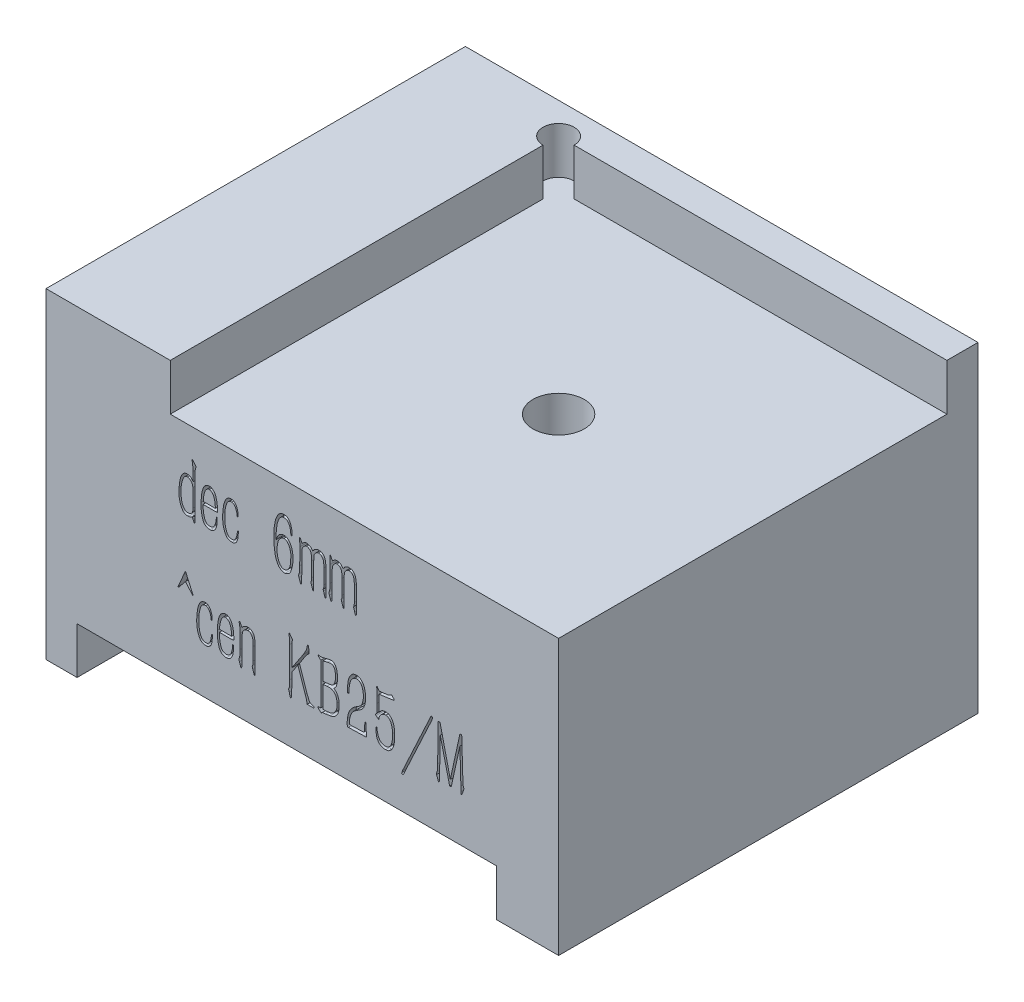
from build123d import *

# Parameters (mm, degrees)
SKETCH_1_W             = 29
SKETCH_1_H             = 29
EXTRUDE_1_DEPTH        = 5
SKETCH_2_W             = 25
SKETCH_2_H             = 25
CUT_EXTRUDE_1_DEPTH    = 3
SKETCH_3_W             = 35
SKETCH_3_H             = 29
EXTRUDE_747_DEPTH      = 12.682335465
SKETCH_4_W             = 29
SKETCH_4_H             = 29
SKETCH_4_W_2           = 25
SKETCH_4_H_2           = 25
EXTRUDE_3_DEPTH        = 3
HOLE_WIZARD_M4_1_D     = 3.3
HOLE_WIZARD_M4_1_DEPTH = 10.1
HOLE_WIZARD_M4_1_TIP   = 0.991420021
HOLE_WIZARD_M4_2_D     = 3.3
HOLE_WIZARD_M4_2_DEPTH = 10.1
HOLE_WIZARD_M4_2_TIP   = 0.991420021
SKETCH_9_R             = 1
CUT_EXTRUDE_2_DEPTH    = 3
SKETCH_10_R            = 1
CUT_EXTRUDE_3_DEPTH    = 3
SKETCH_11_W            = 29
SKETCH_11_H            = 5
EXTRUDE_4_DEPTH        = 6
SKETCH_12_W            = 29
SKETCH_12_H            = 3
EXTRUDE_5_DEPTH        = 6
SKETCH_13_W            = 25
SKETCH_13_H            = 3
CUT_EXTRUDE_4_DEPTH    = 2
SKETCH_14_W            = 27
SKETCH_14_H            = 3
CUT_EXTRUDE_5_DEPTH    = 38.352183947
FILLET_1_R             = 1
CUT_EXTRUDE_8_DEPTH    = 33.530893014
CUT_EXTRUDE_9_DEPTH    = 0.5


with BuildPart() as part:
    # 草图1 → 凸台-拉伸1 (new body)
    with BuildSketch(Plane(origin=(0, 0, 0), x_dir=(1, 0, 0), z_dir=(0, 1, 0))):
        Rectangle(SKETCH_1_W, SKETCH_1_H)
    extrude(amount=EXTRUDE_1_DEPTH)

    # 草图2 → 切除-拉伸1 (cut)
    with BuildSketch(Plane.XZ.offset(-5)):
        Rectangle(SKETCH_2_W, SKETCH_2_H)
    extrude(amount=CUT_EXTRUDE_1_DEPTH, mode=Mode.SUBTRACT)

    # 草图3 → Extrude 747 (add)
    with BuildSketch(Plane(origin=(0, 0, 0), x_dir=(-1, 0, 0), z_dir=(0, -1, 0))):
        with Locations((3, 0)):
            Rectangle(SKETCH_3_W, SKETCH_3_H)
    extrude(amount=EXTRUDE_747_DEPTH)

    # 草图4 → 凸台-拉伸3 (add)
    with BuildSketch(Plane.XZ.offset(12.682335465)):
        with Locations((-6, 0)):
            Rectangle(SKETCH_4_W, SKETCH_4_H)
        with Locations((-6, 0)):
            Rectangle(SKETCH_4_W_2, SKETCH_4_H_2, mode=Mode.SUBTRACT)
    extrude(amount=EXTRUDE_3_DEPTH)

    # M4 螺纹孔1
    with Locations(Plane.ZX.offset(2)):
        with Locations((0, 0)):
            Hole(HOLE_WIZARD_M4_1_D / 2, depth=HOLE_WIZARD_M4_1_DEPTH)
            with Locations((0, 0, -(HOLE_WIZARD_M4_1_DEPTH + HOLE_WIZARD_M4_1_TIP / 2))):  # 118° drill point
                Cone(0, HOLE_WIZARD_M4_1_D / 2, HOLE_WIZARD_M4_1_TIP, mode=Mode.SUBTRACT)

    # M4 螺纹孔2
    with Locations(Plane(origin=(-6, -12.682335465, 0), x_dir=(0, 0, -1), z_dir=(0, -1, 0))):
        with Locations((0, 0)):
            Hole(HOLE_WIZARD_M4_2_D / 2, depth=HOLE_WIZARD_M4_2_DEPTH)
            with Locations((0, 0, -(HOLE_WIZARD_M4_2_DEPTH + HOLE_WIZARD_M4_2_TIP / 2))):  # 118° drill point
                Cone(0, HOLE_WIZARD_M4_2_D / 2, HOLE_WIZARD_M4_2_TIP, mode=Mode.SUBTRACT)

    # 草图9 → 切除-拉伸2 (cut)
    with BuildSketch(Plane(origin=(0, 5, 0), x_dir=(1, 0, 0), z_dir=(0, 1, 0))):
        with Locations((-12.5, 12.5)):
            Circle(SKETCH_9_R)
    extrude(amount=-CUT_EXTRUDE_2_DEPTH, mode=Mode.SUBTRACT)

    # 草图10 → 切除-拉伸3 (cut)
    with BuildSketch(Plane.XZ.offset(15.682335465)):
        with Locations((-18.5, -12.5)):
            Circle(SKETCH_10_R)
    extrude(amount=-CUT_EXTRUDE_3_DEPTH, mode=Mode.SUBTRACT)

    # 草图11 → 凸台-拉伸4 (add)
    with BuildSketch(Plane.ZY.offset(14.5)):
        with Locations((0, 2.5)):
            Rectangle(SKETCH_11_W, SKETCH_11_H)
    extrude(amount=EXTRUDE_4_DEPTH)

    # 草图12 → 凸台-拉伸5 (add)
    with BuildSketch(Plane(origin=(8.5, 0, 0), x_dir=(0, 0, -1), z_dir=(1, 0, 0))):
        with Locations((0, -14.182335465)):
            Rectangle(SKETCH_12_W, SKETCH_12_H)
    extrude(amount=EXTRUDE_5_DEPTH)

    # 草图13 → 切除-拉伸4 (cut)
    with BuildSketch(Plane.ZY.offset(-6.5)):
        with Locations((0, -14.182335465)):
            Rectangle(SKETCH_13_W, SKETCH_13_H)
    extrude(amount=-CUT_EXTRUDE_4_DEPTH, mode=Mode.SUBTRACT)

    # 草图14 → 切除-拉伸5 (cut, through all)
    with BuildSketch(Plane(origin=(0, 0, 12.5), x_dir=(-1, 0, 0), z_dir=(0, 0, -1))):
        with Locations((5, -14.182335465)):
            Rectangle(SKETCH_14_W, SKETCH_14_H)
    extrude(amount=-CUT_EXTRUDE_5_DEPTH, mode=Mode.SUBTRACT)

    # 圆角1
    fillet_1_edges = [part.edges().sort_by_distance(p)[0] for p in [
        (8.5, -14.182335465, -12.5),
    ]]
    fillet(fillet_1_edges, radius=FILLET_1_R)

    # 草图17 → 切除-拉伸8 (cut, through all)
    with BuildSketch(Plane(origin=(0, 5, 0), x_dir=(1, 0, 0), z_dir=(0, 1, 0))):
        Polygon((-20.5, -14.5), (14.5, -14.5), (14.5, 14.5), (12.5, 14.5), (12.5, -12.5), (-20.5, -12.5), align=None)
    extrude(amount=-CUT_EXTRUDE_8_DEPTH, mode=Mode.SUBTRACT)

    # 草图19 → 切除-拉伸9 (cut)
    # profile 1 of 16: a face of its own
    with BuildSketch(Plane.XY.offset(12.5)):
        with BuildLine():
            add(Edge.make_bspline(
                [(-11.044492941, -2.974944262), (-11.052797833, -2.983553236), (-11.068073813, -2.999388545), (-11.091020176, -3.018877474), (-11.108377837, -3.035977769), (-11.130185321, -3.05240054), (-11.164091386, -3.068805724), (-11.212950427, -3.086790624), (-11.270414925, -3.103224215), (-11.311389003, -3.108214195), (-11.331622709, -3.110678334)],
                knots=[0, 0, 0, 0, 0.879355684, 1.617482872, 2.212903112, 2.670107794, 3.61898101, 4.967479073, 6.502488896, 8, 8, 8, 8], degree=3))
            add(Edge.make_bspline(
                [(-11.331622709, -3.110678334), (-11.346780272, -3.111773552), (-11.377604955, -3.114000806), (-11.424964764, -3.110770934), (-11.473723364, -3.101650927), (-11.522377765, -3.086942389), (-11.568885314, -3.068197474), (-11.61001057, -3.044854406), (-11.645926254, -3.019109599), (-11.68484275, -2.976822535), (-11.726568332, -2.913571284), (-11.777083843, -2.831047973), (-11.820602915, -2.738951055), (-11.853541013, -2.658403795), (-11.874195613, -2.588493994), (-11.888868131, -2.5282236), (-11.90308235, -2.459825778), (-11.920532881, -2.359899448), (-11.936139108, -2.233614683), (-11.941470836, -2.084999523), (-11.938888125, -1.94043095), (-11.933307235, -1.844806887), (-11.930493367, -1.796593526)],
                knots=[0, 0, 0, 0, 0.561153209, 1.141170844, 1.748491507, 2.390938135, 3.017147985, 3.59723839, 4.135665825, 4.642597419, 5.710714825, 6.93035013, 8.216589597, 9.470659678, 10.142147783, 10.908737258, 11.762887299, 12.723607028, 14.657615208, 16.459987768, 18.215136671, 20, 20, 20, 20], degree=3))
            add(Edge.make_bspline(
                [(-11.930493367, -1.796593526), (-11.926079935, -1.728873413), (-11.91757434, -1.598362781), (-11.892770052, -1.440033533), (-11.867335225, -1.32422399), (-11.848281575, -1.246623499), (-11.826901709, -1.177614163), (-11.79667532, -1.098468878), (-11.75437924, -1.012144588), (-11.701934315, -0.93758148), (-11.656646745, -0.887316877), (-11.620700062, -0.856613238), (-11.582849767, -0.831644009), (-11.542976, -0.811641096), (-11.4992938, -0.798464832), (-11.452358486, -0.789238673), (-11.400715573, -0.786547382), (-11.365172033, -0.788664811), (-11.346538541, -0.78977486)],
                knots=[0, 0, 0, 0, 2.497492919, 4.81318413, 5.890255067, 6.862487719, 7.754051724, 8.547806014, 9.980331848, 11.280441557, 11.889312327, 12.467053852, 13.01533858, 13.55562097, 14.102682188, 14.689629037, 15.313045707, 16, 16, 16, 16], degree=3))
            add(Edge.make_bspline(
                [(-11.346538541, -0.78977486), (-11.329314169, -0.793727607), (-11.294382742, -0.80174387), (-11.241073761, -0.819573951), (-11.185819057, -0.849891439), (-11.138144366, -0.897268212), (-11.096623175, -0.94340456), (-11.073919, -0.974103148), (-11.064629314, -0.986663844)],
                knots=[0, 0, 0, 0, 0.896966184, 1.819068224, 2.847669649, 4.062670352, 5.207318296, 6, 6, 6, 6], degree=3))
            Line((-11.064629314, -0.986663844), (-11.0392724, -1.036631881))
            Line((-11.0392724, -1.036631881), (-11.0392724, -0.467592887))
            add(Edge.make_bspline(
                [(-11.0392724, -0.467592887), (-11.039111021, -0.445216992), (-11.038806149, -0.402945198), (-11.040823592, -0.343046897), (-11.04192912, -0.290073109), (-11.045090805, -0.227641409), (-11.05046288, -0.152398312), (-11.059992745, -0.078693038), (-11.068121116, -0.022610323), (-11.072638171, 0.012410162), (-11.078633217, 0.039219665), (-11.082972827, 0.054227324), (-11.084765688, 0.060427569)],
                knots=[0, 0, 0, 0, 1.263505711, 2.386972818, 3.38413382, 4.255567226, 5.91697507, 7.642624453, 8.450687819, 9.117796617, 9.635527599, 10, 10, 10, 10], degree=3))
            Line((-11.084765688, 0.060427569), (-11.110122602, 0.140973062))
            Line((-11.110122602, 0.140973062), (-11.064629314, 0.191686891))
            Line((-11.064629314, 0.191686891), (-10.837908666, -0.105138167))
            add(Edge.make_bspline(
                [(-10.837908666, -0.105138167), (-10.844028374, -0.122237774), (-10.855130739, -0.153259855), (-10.8691054, -0.199246658), (-10.879817301, -0.247249336), (-10.890215314, -0.292778912), (-10.897116315, -0.339887132), (-10.899525712, -0.387760471), (-10.900213699, -0.446717248), (-10.89898529, -0.489719325), (-10.898317786, -0.513086175)],
                knots=[0, 0, 0, 0, 1.048338351, 1.901893893, 2.772055039, 3.886563933, 4.596854284, 5.517048343, 6.650791698, 8, 8, 8, 8], degree=3))
            Line((-10.898317786, -0.513086175), (-10.898317786, -2.854126022))
            Line((-10.898317786, -2.854126022), (-10.908758869, -3.136035248))
            add(Edge.make_bspline(
                [(-10.908758869, -3.136035248), (-10.909180647, -3.159211787), (-10.909951788, -3.201585629), (-10.917579608, -3.250540479), (-10.926987671, -3.281034973), (-10.930639789, -3.294896497), (-10.937267355, -3.304282862), (-10.941993374, -3.302884578), (-10.943811074, -3.302346776)],
                knots=[0, 0, 0, 0, 2.347262844, 4.291518495, 5.025821604, 5.536408152, 5.821695443, 6, 6, 6, 6], degree=3))
            add(Edge.make_bspline(
                [(-10.943811074, -3.302346776), (-10.946076537, -3.301681383), (-10.952647043, -3.299751548), (-10.965306002, -3.291202316), (-10.977329115, -3.267326117), (-10.987637793, -3.240369767), (-10.995591392, -3.214921167), (-10.99976625, -3.19888201), (-11.003379442, -3.188628023), (-11.004013068, -3.183277555), (-11.004220194, -3.181528536)],
                knots=[0, 0, 0, 0, 0.403613105, 1.170596012, 2.52802742, 4.858677114, 6.150519307, 7.079706455, 7.699164553, 8, 8, 8, 8], degree=3))
            Line((-11.004220194, -3.181528536), (-11.0392724, -3.121119416))
            add(Edge.make_bspline(
                [(-11.0392724, -3.121119416), (-11.044302063, -3.112304605), (-11.053512729, -3.096162317), (-11.062038723, -3.071821637), (-11.065536981, -3.049454916), (-11.061364175, -3.036298171), (-11.059408773, -3.03013284)],
                knots=[0, 0, 0, 0, 1.258222532, 2.304143687, 3.20531149, 4, 4, 4, 4], degree=3))
            Line((-11.059408773, -3.03013284), (-11.044492941, -2.974944262))
        make_face()
        with BuildLine():
            add(Edge.make_bspline(
                [(-11.0392724, -1.349118564), (-11.043887413, -1.329206281), (-11.05445421, -1.283613982), (-11.070707009, -1.223736183), (-11.09069953, -1.169745526), (-11.114382241, -1.126978906), (-11.146721224, -1.085930502), (-11.185163691, -1.045898926), (-11.228400672, -1.009863147), (-11.276621666, -0.981801992), (-11.327540286, -0.960955544), (-11.36352558, -0.954238104), (-11.381590746, -0.950865847)],
                knots=[0, 0, 0, 0, 1.087070677, 2.489019121, 3.296777195, 4.143001111, 5.076437859, 6.067544693, 7.091696007, 8.057616984, 9.024894148, 10, 10, 10, 10], degree=3))
            add(Edge.make_bspline(
                [(-11.381590746, -0.950865847), (-11.40512871, -0.950998163), (-11.45040182, -0.95125266), (-11.515344358, -0.974213679), (-11.572057779, -1.018625044), (-11.622903833, -1.081844736), (-11.669425366, -1.163336909), (-11.702911699, -1.243071097), (-11.725500557, -1.317046534), (-11.743927125, -1.381212398), (-11.75955934, -1.453355357), (-11.781421608, -1.560688585), (-11.800509799, -1.706943857), (-11.80827767, -1.857910533), (-11.807348527, -1.978566849), (-11.807289216, -2.060880059), (-11.804300985, -2.133508124), (-11.800841165, -2.178446615), (-11.799234045, -2.199320993)],
                knots=[0, 0, 0, 0, 0.783361284, 1.506723473, 2.255226992, 3.164604672, 4.204458994, 5.386075289, 6.048912043, 6.79147791, 7.618687083, 8.51739171, 10.455773016, 12.546064137, 13.569018947, 14.492210749, 15.299616831, 16, 16, 16, 16], degree=3))
            add(Edge.make_bspline(
                [(-11.799234045, -2.199320993), (-11.79471095, -2.252377294), (-11.786032883, -2.354171774), (-11.762635797, -2.47728216), (-11.736089342, -2.566570122), (-11.714379563, -2.62765084), (-11.690143901, -2.684195361), (-11.662576674, -2.735506955), (-11.632939143, -2.781646297), (-11.599895472, -2.820942789), (-11.565785801, -2.855224699), (-11.52865707, -2.882316525), (-11.489375204, -2.90373238), (-11.447313439, -2.918508596), (-11.402636104, -2.927874905), (-11.371943384, -2.928917393), (-11.356233832, -2.929450974)],
                knots=[0, 0, 0, 0, 2.381856977, 4.569860435, 5.590536306, 6.547523977, 7.469144364, 8.340031829, 9.151419551, 9.917633247, 10.633421254, 11.309747946, 11.966679376, 12.628115531, 13.297824026, 14, 14, 14, 14], degree=3))
            add(Edge.make_bspline(
                [(-11.356233832, -2.929450974), (-11.341049071, -2.929887421), (-11.312309592, -2.930713465), (-11.271741861, -2.925217099), (-11.235869492, -2.916164569), (-11.196461369, -2.895637642), (-11.155757051, -2.864238697), (-11.116299145, -2.820144106), (-11.086370406, -2.771822), (-11.063881915, -2.727689378), (-11.049794589, -2.683576154), (-11.044498272, -2.636218758), (-11.039770367, -2.576048189), (-11.039448968, -2.531216477), (-11.0392724, -2.506587134)],
                knots=[0, 0, 0, 0, 0.90232711, 1.707791825, 2.429131959, 3.090661387, 4.336200266, 5.467589662, 6.591897801, 7.70996082, 8.407082277, 9.33381394, 10.535268674, 12, 12, 12, 12], degree=3))
            Line((-11.0392724, -2.506587134), (-11.0392724, -1.349118564))
        make_face(mode=Mode.SUBTRACT)
    # profile 2 of 16: a face of its own
    with BuildSketch(Plane.XY.offset(12.5)):
        with BuildLine():
            add(Edge.make_bspline(
                [(-10.387450537, -1.973346137), (-10.386838023, -2.018837817), (-10.385652758, -2.106868004), (-10.381629536, -2.238925125), (-10.366464887, -2.37501264), (-10.345426435, -2.49295096), (-10.323857245, -2.590212373), (-10.303355406, -2.658692098), (-10.282084548, -2.721382021), (-10.258679649, -2.778154688), (-10.230165096, -2.827813676), (-10.196996299, -2.871432794), (-10.158001009, -2.907941083), (-10.114593169, -2.937988026), (-10.067845108, -2.96057132), (-10.019042651, -2.973796013), (-9.969361478, -2.97969995), (-9.936490805, -2.976543337), (-9.919839201, -2.974944262)],
                knots=[0, 0, 0, 0, 1.76204207, 3.409697979, 5.11395677, 7.059205991, 8.047077356, 8.970149115, 9.825684356, 10.610712091, 11.343909347, 12.037145518, 12.725012886, 13.403314297, 14.075093758, 14.724422763, 15.353818929, 16, 16, 16, 16], degree=3))
            add(Edge.make_bspline(
                [(-9.919839201, -2.974944262), (-9.896166277, -2.971324689), (-9.847528778, -2.96388805), (-9.77888887, -2.931061769), (-9.715980866, -2.883992363), (-9.670747265, -2.832147603), (-9.640490379, -2.780798227), (-9.618950944, -2.732812164), (-9.600157402, -2.675582488), (-9.575557558, -2.589059317), (-9.551665921, -2.476486281), (-9.541969419, -2.384879662), (-9.537248108, -2.340275606)],
                knots=[0, 0, 0, 0, 0.885101797, 1.818496837, 2.787576385, 3.788650184, 4.347386781, 4.995874406, 5.737214192, 6.581533873, 8.335519231, 10, 10, 10, 10], degree=3))
            Line((-9.537248108, -2.340275606), (-9.532027567, -2.229898449))
            Line((-9.532027567, -2.229898449), (-9.476838988, -2.229898449))
            add(Edge.make_bspline(
                [(-9.476838988, -2.229898449), (-9.477181017, -2.269428403), (-9.477850169, -2.346765449), (-9.481493248, -2.461671582), (-9.488554498, -2.57677237), (-9.502877905, -2.693922082), (-9.52764536, -2.812993024), (-9.566864842, -2.906975374), (-9.604989429, -2.976551471), (-9.637273452, -3.022808801), (-9.673327152, -3.06238354), (-9.712403836, -3.097002979), (-9.757150568, -3.124447961), (-9.808825994, -3.143735032), (-9.866719186, -3.157382341), (-9.908072472, -3.160022132), (-9.929534492, -3.161392163)],
                knots=[0, 0, 0, 0, 1.434111755, 2.805719551, 4.170550116, 5.615848384, 7.086143433, 8.566665163, 9.289356505, 9.962455767, 10.607351366, 11.227557666, 11.850903609, 12.499070256, 13.221029645, 14, 14, 14, 14], degree=3))
            add(Edge.make_bspline(
                [(-9.929534492, -3.161392163), (-9.948178617, -3.162046973), (-9.986065365, -3.163377613), (-10.045613173, -3.157560879), (-10.109939889, -3.139104884), (-10.166643825, -3.11442185), (-10.215165788, -3.08747625), (-10.250606206, -3.057999805), (-10.286749564, -3.024835748), (-10.321417262, -2.984472986), (-10.35532235, -2.93633822), (-10.383022091, -2.876374351), (-10.411435039, -2.807918966), (-10.441950188, -2.701421549), (-10.474048353, -2.560078137), (-10.499645087, -2.412736939), (-10.512450414, -2.285769096), (-10.518076143, -2.175774032), (-10.520032977, -2.051410555), (-10.519166425, -1.963650432), (-10.51870986, -1.917411766)],
                knots=[0, 0, 0, 0, 0.650716781, 1.322322339, 2.077884039, 2.975531408, 3.476984577, 4.008103694, 4.578906285, 5.187735186, 5.861522467, 6.625849046, 7.486119807, 8.446708295, 10.485901071, 12.543959079, 13.660129477, 14.937308151, 16.38634249, 18, 18, 18, 18], degree=3))
            add(Edge.make_bspline(
                [(-10.51870986, -1.917411766), (-10.517496612, -1.883354146), (-10.515158169, -1.817710678), (-10.511302611, -1.722911826), (-10.504013071, -1.635464009), (-10.494992084, -1.53023266), (-10.477251568, -1.41013266), (-10.451023148, -1.274329134), (-10.412552246, -1.145789003), (-10.372011513, -1.041841743), (-10.331091244, -0.963456754), (-10.296099619, -0.911678159), (-10.257199302, -0.867408936), (-10.213501256, -0.832686716), (-10.168661001, -0.804751113), (-10.125284471, -0.781501852), (-10.082819437, -0.764284484), (-10.054435288, -0.757847304), (-10.040657441, -0.754722655)],
                knots=[0, 0, 0, 0, 1.213095943, 2.338150009, 3.376520911, 4.336281797, 6.097019825, 7.695329025, 9.25485731, 10.866825436, 11.658535576, 12.397293119, 13.086593193, 13.74718025, 14.375633647, 14.965392972, 15.497795151, 16, 16, 16, 16], degree=3))
            add(Edge.make_bspline(
                [(-10.040657441, -0.754722655), (-10.020536182, -0.752377489), (-9.980442139, -0.747704462), (-9.919235545, -0.75605477), (-9.85896472, -0.776120963), (-9.799767414, -0.806489805), (-9.744867378, -0.846651621), (-9.694328852, -0.893240181), (-9.652110197, -0.948140758), (-9.604887211, -1.029394764), (-9.557974442, -1.138373853), (-9.521565871, -1.272379246), (-9.496399481, -1.399078857), (-9.478885642, -1.512135881), (-9.468733195, -1.610285044), (-9.461529703, -1.696823188), (-9.457933634, -1.777646724), (-9.456249596, -1.842632205), (-9.457185234, -1.890773693), (-9.45862781, -1.919781045), (-9.463364753, -1.940056011), (-9.467824793, -1.956559397), (-9.482908033, -1.964574761), (-9.50388736, -1.97037072), (-9.535040885, -1.972136365), (-9.558901313, -1.972911086), (-9.572300314, -1.973346137)],
                knots=[0, 0, 0, 0, 0.90721453, 1.807734678, 2.747307979, 3.751390273, 4.783655069, 5.795103352, 6.829601641, 7.881263504, 10.012312392, 12.137264012, 14.108749857, 15.814809167, 17.275250144, 18.541409357, 19.715543979, 20.910897557, 21.45832083, 21.884085443, 22.203933474, 22.409283662, 22.610646089, 22.925184254, 23.396429255, 24, 24, 24, 24], degree=3))
            Line((-9.572300314, -1.973346137), (-10.387450537, -1.973346137))
        make_face()
        with BuildLine():
            add(Edge.make_bspline(
                [(-9.597657228, -1.801814068), (-9.598018732, -1.767492766), (-9.598761077, -1.697014148), (-9.607496404, -1.587443982), (-9.622955084, -1.468676215), (-9.644761762, -1.36490563), (-9.666619792, -1.281033366), (-9.685016524, -1.222699094), (-9.706683933, -1.171495048), (-9.736806626, -1.112639822), (-9.780191668, -1.049586894), (-9.833961086, -0.999621188), (-9.87974871, -0.968905109), (-9.915598468, -0.953079004), (-9.952318678, -0.942718111), (-9.977446434, -0.941684579), (-9.989943612, -0.941170556)],
                knots=[0, 0, 0, 0, 1.402160222, 2.87932884, 4.488366798, 6.293324403, 7.207447842, 8.029821475, 8.790125887, 9.476160448, 10.73027422, 11.894704905, 12.452573132, 12.975497519, 13.490468219, 14, 14, 14, 14], degree=3))
            add(Edge.make_bspline(
                [(-9.989943612, -0.941170556), (-10.005720171, -0.943071957), (-10.03698569, -0.946840098), (-10.082723567, -0.963133893), (-10.124957109, -0.990061573), (-10.165333858, -1.024293906), (-10.20135236, -1.066222482), (-10.234002842, -1.113789234), (-10.261425739, -1.167473311), (-10.290818679, -1.247721609), (-10.320534001, -1.355532604), (-10.345022439, -1.466602605), (-10.358161846, -1.556121805), (-10.367036463, -1.618906861), (-10.371493034, -1.676951259), (-10.372198834, -1.714053632), (-10.372534705, -1.731709657)],
                knots=[0, 0, 0, 0, 0.702397871, 1.391991334, 2.12851606, 2.909621492, 3.728984972, 4.568882301, 5.460255199, 6.390760514, 8.349475764, 10.409799172, 11.423618189, 12.356466038, 13.21788624, 14, 14, 14, 14], degree=3))
            Line((-10.372534705, -1.731709657), (-10.377755247, -1.801814068))
            Line((-10.377755247, -1.801814068), (-9.597657228, -1.801814068))
        make_face(mode=Mode.SUBTRACT)
    # profile 3 of 16: a face of its own
    with BuildSketch(Plane.XY.offset(12.5)):
        with BuildLine():
            Line((-8.132922517, -1.554957047), (-8.188111096, -1.554957047))
            add(Edge.make_bspline(
                [(-8.188111096, -1.554957047), (-8.191610244, -1.525343652), (-8.198452303, -1.467439113), (-8.212870818, -1.379880501), (-8.234305866, -1.288392453), (-8.265286158, -1.19188526), (-8.305990979, -1.094797308), (-8.356332079, -1.0239503), (-8.403144618, -0.976586214), (-8.444123816, -0.949312176), (-8.490372396, -0.930382587), (-8.523317501, -0.924192242), (-8.540124733, -0.921034183)],
                knots=[0, 0, 0, 0, 1.149325117, 2.247332431, 3.418774536, 4.767303545, 6.152776191, 7.458301375, 8.088483276, 8.710378256, 9.342088225, 10, 10, 10, 10], degree=3))
            add(Edge.make_bspline(
                [(-8.540124733, -0.921034183), (-8.554066647, -0.920623268), (-8.581318177, -0.919820075), (-8.621086329, -0.925570615), (-8.659081364, -0.934730673), (-8.705223022, -0.956172731), (-8.758455058, -0.992194952), (-8.801907913, -1.041838119), (-8.831192387, -1.090637436), (-8.853556653, -1.135802576), (-8.875548802, -1.18917394), (-8.904455532, -1.27156577), (-8.935686773, -1.383300836), (-8.961124891, -1.500856016), (-8.976118702, -1.60317493), (-8.983975763, -1.691061366), (-8.988881445, -1.789583887), (-8.991645141, -1.894272969), (-8.992465672, -1.996220627), (-8.991148671, -2.086701852), (-8.991222081, -2.161064462), (-8.989222185, -2.205290469), (-8.988345487, -2.224677907)],
                knots=[0, 0, 0, 0, 0.551952575, 1.078872776, 1.58807234, 2.09545623, 3.08786337, 4.114291427, 4.680578306, 5.34175874, 6.110549827, 6.967820965, 8.802310402, 10.706413118, 11.732320494, 12.900405929, 14.203265102, 15.642824285, 17.052309072, 18.244961613, 19.230640491, 20, 20, 20, 20], degree=3))
            add(Edge.make_bspline(
                [(-8.988345487, -2.224677907), (-8.98248175, -2.279236261), (-8.971276139, -2.383497364), (-8.941811274, -2.531530545), (-8.900693586, -2.664340361), (-8.857115895, -2.764125762), (-8.817360478, -2.834569925), (-8.78491105, -2.878017905), (-8.751616225, -2.914706259), (-8.714991382, -2.942715218), (-8.676070946, -2.964265783), (-8.633731877, -2.979137267), (-8.587996139, -2.988247819), (-8.556326832, -2.989314418), (-8.540124733, -2.989860094)],
                knots=[0, 0, 0, 0, 2.033437024, 3.88590151, 5.585149186, 7.177668939, 7.912645581, 8.578002538, 9.18432636, 9.742823951, 10.278978723, 10.826961574, 11.3998705, 12, 12, 12, 12], degree=3))
            add(Edge.make_bspline(
                [(-8.540124733, -2.989860094), (-8.524944557, -2.99032641), (-8.496179523, -2.991210036), (-8.45530161, -2.985292445), (-8.419568958, -2.973480407), (-8.379700993, -2.949999032), (-8.338486107, -2.91227976), (-8.303492217, -2.868215932), (-8.280037733, -2.826813148), (-8.263191934, -2.78916357), (-8.245949682, -2.745971947), (-8.223683041, -2.678621178), (-8.200706138, -2.58508332), (-8.192397505, -2.506734438), (-8.188111096, -2.466314387)],
                knots=[0, 0, 0, 0, 0.778483857, 1.475155138, 2.108774206, 2.697628175, 3.836956611, 4.955146463, 5.572491136, 6.274866731, 7.071139709, 7.958995552, 9.915252893, 12, 12, 12, 12], degree=3))
            Line((-8.188111096, -2.466314387), (-8.173195264, -2.335800856))
            Line((-8.173195264, -2.335800856), (-8.117260893, -2.335800856))
            add(Edge.make_bspline(
                [(-8.117260893, -2.335800856), (-8.118782708, -2.374582273), (-8.121611666, -2.446674484), (-8.125169152, -2.548623482), (-8.129352084, -2.641900909), (-8.141399429, -2.730428101), (-8.159727451, -2.816987292), (-8.186138385, -2.898579819), (-8.219600099, -2.974086416), (-8.263258313, -3.038286745), (-8.315250306, -3.089961485), (-8.376207577, -3.126032959), (-8.44545098, -3.147776892), (-8.494466161, -3.149864213), (-8.51998836, -3.15095108)],
                knots=[0, 0, 0, 0, 1.372472627, 2.551340215, 3.608101763, 4.672406108, 5.707031168, 6.732916513, 7.700609824, 8.617490186, 9.463020092, 10.271159828, 11.099793127, 12, 12, 12, 12], degree=3))
            add(Edge.make_bspline(
                [(-8.51998836, -3.15095108), (-8.552917568, -3.150751651), (-8.618667361, -3.150353451), (-8.698685567, -3.1306503), (-8.757575776, -3.105868337), (-8.797410936, -3.083396318), (-8.83313605, -3.057230768), (-8.874344912, -3.015196815), (-8.918806664, -2.95270584), (-8.966267485, -2.868453807), (-9.007777653, -2.773810476), (-9.039671339, -2.689122104), (-9.062675322, -2.614957509), (-9.077825131, -2.552103085), (-9.092021369, -2.482665328), (-9.109854681, -2.382557024), (-9.125498323, -2.254001896), (-9.130523046, -2.100409497), (-9.1281105, -1.950126497), (-9.122426896, -1.851022361), (-9.11960481, -1.801814068)],
                knots=[0, 0, 0, 0, 1.071620834, 2.139706731, 2.659377754, 3.153287329, 3.628534099, 4.098772274, 5.067123939, 6.120327215, 7.249274086, 8.434827949, 9.071033969, 9.781107684, 10.542969812, 11.38296812, 13.098086903, 14.761895379, 16.392180083, 18, 18, 18, 18], degree=3))
            add(Edge.make_bspline(
                [(-9.11960481, -1.801814068), (-9.115141307, -1.733354541), (-9.106456141, -1.600144741), (-9.081793533, -1.438087987), (-9.056461195, -1.317959713), (-9.036898354, -1.23734803), (-9.014287121, -1.165529729), (-8.990608395, -1.101316736), (-8.964027411, -1.044321627), (-8.936816881, -0.992753449), (-8.907482474, -0.946973621), (-8.876760454, -0.905913874), (-8.843246331, -0.870157765), (-8.806901275, -0.838892113), (-8.767350761, -0.812759588), (-8.724685293, -0.791857412), (-8.679822058, -0.776318301), (-8.633155633, -0.765353494), (-8.584624133, -0.761751702), (-8.55204718, -0.764021342), (-8.535649983, -0.765163737)],
                knots=[0, 0, 0, 0, 2.793496182, 5.435635993, 6.666912024, 7.794156976, 8.812594716, 9.732261976, 10.579509119, 11.37230304, 12.105428973, 12.791971314, 13.458200826, 14.097411822, 14.740540715, 15.38358989, 16.027276536, 16.670883533, 17.331006038, 18, 18, 18, 18], degree=3))
            add(Edge.make_bspline(
                [(-8.535649983, -0.765163737), (-8.52017639, -0.769434111), (-8.48520624, -0.779085108), (-8.43989467, -0.796099295), (-8.399176685, -0.81650105), (-8.365565949, -0.839495584), (-8.332174344, -0.870172829), (-8.297154421, -0.906888243), (-8.263662229, -0.9520179), (-8.231881418, -1.005835586), (-8.205995401, -1.070118195), (-8.182211069, -1.139869695), (-8.162866659, -1.21043969), (-8.148297804, -1.276349877), (-8.139665789, -1.335218858), (-8.138116511, -1.372215711), (-8.137397267, -1.38939131)],
                knots=[0, 0, 0, 0, 0.844735025, 1.909091764, 2.541087308, 3.237889904, 4.044153303, 4.923543645, 5.90488005, 6.995532933, 8.203352133, 9.543985212, 10.874041012, 12.052008099, 13.095654739, 14, 14, 14, 14], degree=3))
            Line((-8.137397267, -1.38939131), (-8.132922517, -1.554957047))
        make_face()
    # profile 4 of 16: a face of its own
    with BuildSketch(Plane.XY.offset(12.5)):
        with BuildLine():
            Line((-4.660516806, -0.880761436), (-4.730621217, -0.880761436))
            add(Edge.make_bspline(
                [(-4.730621217, -0.880761436), (-4.735412795, -0.850721394), (-4.744893189, -0.791285552), (-4.753624955, -0.700461889), (-4.764273771, -0.606087563), (-4.782506448, -0.50623108), (-4.811193371, -0.402414438), (-4.851543876, -0.319881554), (-4.889715489, -0.258039685), (-4.922257265, -0.216684338), (-4.959590784, -0.182042967), (-4.999494021, -0.152879815), (-5.04246456, -0.130332715), (-5.087515218, -0.114063143), (-5.135326511, -0.106784288), (-5.183990033, -0.107242798), (-5.231371681, -0.112761088), (-5.27538296, -0.124236602), (-5.315067264, -0.139771165), (-5.351904302, -0.160341194), (-5.385705628, -0.19008696), (-5.420962568, -0.227363467), (-5.456330822, -0.275953961), (-5.493351269, -0.333346295), (-5.5292308, -0.40038159), (-5.560886107, -0.476689919), (-5.589153894, -0.561204984), (-5.62198233, -0.686102934), (-5.652422973, -0.853806142), (-5.670679254, -1.025385224), (-5.679311149, -1.160141365), (-5.683595111, -1.250407013), (-5.68710771, -1.328706413), (-5.687357358, -1.376958339), (-5.687471846, -1.399086601)],
                knots=[0, 0, 0, 0, 1.172618578, 2.320089015, 3.517365984, 4.833421129, 6.231766425, 7.655217032, 8.357323983, 9.032478261, 9.676711985, 10.315215253, 10.932648665, 11.54199308, 12.153444918, 12.786093219, 13.413857257, 13.988112725, 14.53457488, 15.054145165, 15.605211832, 16.262994999, 17.029841423, 17.917944275, 18.895673466, 19.956732694, 21.09950916, 22.329492637, 24.933332206, 27.662278065, 28.97833321, 30.139613505, 31.146829503, 32, 32, 32, 32], degree=3))
            Line((-5.687471846, -1.399086601), (-5.691946595, -1.595229793))
            add(Edge.make_bspline(
                [(-5.691946595, -1.595229793), (-5.679497176, -1.560101345), (-5.656994689, -1.496606218), (-5.622444523, -1.409002994), (-5.583322752, -1.334719446), (-5.537716676, -1.266029873), (-5.478699063, -1.202632773), (-5.418409346, -1.156314268), (-5.361718734, -1.124298602), (-5.311375558, -1.105950336), (-5.25469262, -1.093275766), (-5.214704174, -1.08938417), (-5.193757804, -1.087345711)],
                knots=[0, 0, 0, 0, 1.463710204, 2.645675197, 3.693667506, 4.755032446, 5.874045908, 7.078730407, 7.725382873, 8.423483439, 9.174203962, 10, 10, 10, 10], degree=3))
            add(Edge.make_bspline(
                [(-5.193757804, -1.087345711), (-5.163496555, -1.088502865), (-5.105948009, -1.090703453), (-5.023099003, -1.115472221), (-4.945647753, -1.158935603), (-4.885987298, -1.212079528), (-4.837825483, -1.26452633), (-4.802351375, -1.312552463), (-4.767734931, -1.366876807), (-4.723239568, -1.448278699), (-4.67525889, -1.559292789), (-4.640590111, -1.677918463), (-4.622581566, -1.778427568), (-4.610838912, -1.85944306), (-4.604620503, -1.94590634), (-4.600997068, -2.066784342), (-4.602772955, -2.217655512), (-4.611000147, -2.337568521), (-4.615023518, -2.396209976)],
                knots=[0, 0, 0, 0, 0.909148716, 1.728949998, 2.576991438, 3.564625719, 4.121218537, 4.72026629, 5.360049571, 6.060456872, 7.512703724, 8.993852322, 9.770776208, 10.587253518, 11.458483217, 12.380006039, 14.229702395, 16, 16, 16, 16], degree=3))
            add(Edge.make_bspline(
                [(-4.615023518, -2.396209976), (-4.619723565, -2.426587418), (-4.629471358, -2.489589558), (-4.650126122, -2.58677627), (-4.67546319, -2.690007327), (-4.704571713, -2.795497548), (-4.738275554, -2.895660489), (-4.782865363, -2.981018323), (-4.836792356, -3.04803002), (-4.899101851, -3.09422895), (-4.960638523, -3.124672075), (-5.015674219, -3.148239608), (-5.063578806, -3.165247757), (-5.094223145, -3.169277068), (-5.107991769, -3.171087454)],
                knots=[0, 0, 0, 0, 1.110217054, 2.302565578, 3.587623031, 4.949459538, 6.256081064, 7.397105523, 8.411240029, 9.334418742, 10.173869837, 10.886090718, 11.499516107, 12, 12, 12, 12], degree=3))
            add(Edge.make_bspline(
                [(-5.107991769, -3.171087454), (-5.133117885, -3.173193855), (-5.183213467, -3.177393527), (-5.246483771, -3.165900331), (-5.297221916, -3.148187535), (-5.338338804, -3.127019395), (-5.38403295, -3.10137603), (-5.431643363, -3.067890057), (-5.48001683, -3.028940652), (-5.523302585, -2.980820246), (-5.563190292, -2.927100341), (-5.609179367, -2.845812374), (-5.657547342, -2.73795489), (-5.702421493, -2.625969142), (-5.731308106, -2.52687988), (-5.750894024, -2.438129178), (-5.769415577, -2.335113126), (-5.7854161, -2.222821862), (-5.799532732, -2.111869366), (-5.811332769, -2.012383112), (-5.821313168, -1.929659305), (-5.830393597, -1.841735187), (-5.836728206, -1.743996524), (-5.838775869, -1.62879175), (-5.836815224, -1.507452998), (-5.834256481, -1.423445769), (-5.832901209, -1.378950228)],
                knots=[0, 0, 0, 0, 0.848219995, 1.691151707, 2.144998995, 2.659153853, 3.249319417, 3.912736756, 4.621867519, 5.340468245, 6.090710837, 6.87657341, 8.487178015, 10.078339935, 10.944022033, 11.968008362, 13.14490399, 14.476453821, 15.796264219, 16.920399402, 17.85823784, 18.608902694, 19.903936842, 21.162934464, 22.497310667, 24, 24, 24, 24], degree=3))
            add(Edge.make_bspline(
                [(-5.832901209, -1.378950228), (-5.832003823, -1.343397376), (-5.830315422, -1.276505838), (-5.826494264, -1.182535689), (-5.822547122, -1.101422139), (-5.814101437, -1.008370333), (-5.800186876, -0.894355277), (-5.778245919, -0.754832657), (-5.752503654, -0.614867668), (-5.724440535, -0.502320522), (-5.69743642, -0.416181471), (-5.672054447, -0.350290408), (-5.640152926, -0.282818974), (-5.605496082, -0.213373132), (-5.565919081, -0.147399918), (-5.522337319, -0.088077358), (-5.475296377, -0.037991351), (-5.424941733, 0.004408274), (-5.368103003, 0.036440744), (-5.30467213, 0.05907653), (-5.233724105, 0.070803797), (-5.184349839, 0.070846482), (-5.158705598, 0.070868651)],
                knots=[0, 0, 0, 0, 1.211628523, 2.279639787, 3.204225299, 3.977932759, 5.462339825, 7.116605252, 8.789327199, 10.30942825, 11.064792467, 11.863814246, 12.712679163, 13.606614715, 14.50718602, 15.330439464, 16.109367713, 16.843542067, 17.564206182, 18.319665359, 19.127259812, 20, 20, 20, 20], degree=3))
            add(Edge.make_bspline(
                [(-5.158705598, 0.070868651), (-5.132714401, 0.068717011), (-5.083598255, 0.064651009), (-5.015898366, 0.046216534), (-4.957744241, 0.021738395), (-4.911706196, -0.012960108), (-4.875576868, -0.051223398), (-4.842191298, -0.085979), (-4.815930746, -0.121197208), (-4.793090347, -0.15574335), (-4.774201394, -0.194099284), (-4.755281103, -0.237473985), (-4.7377802, -0.288518902), (-4.720767519, -0.344342579), (-4.704886829, -0.400551149), (-4.691361415, -0.452748189), (-4.680890574, -0.498759102), (-4.670292291, -0.554261371), (-4.661507766, -0.627166737), (-4.660866035, -0.687070799), (-4.660516806, -0.71967045)],
                knots=[0, 0, 0, 0, 1.358046768, 2.566331314, 3.646368544, 4.629682629, 5.546946845, 6.391627168, 7.141431054, 7.835891544, 8.549473584, 9.368770778, 10.304200405, 11.362836174, 12.414134618, 13.351720444, 14.176238426, 14.875889185, 16.299866179, 18, 18, 18, 18], degree=3))
            Line((-4.660516806, -0.71967045), (-4.660516806, -0.880761436))
        make_face()
        with BuildLine():
            add(Edge.make_bspline(
                [(-5.627062726, -2.123996041), (-5.625554828, -2.168794163), (-5.622460134, -2.260734425), (-5.603655652, -2.400175429), (-5.570960656, -2.541644745), (-5.531890012, -2.65756898), (-5.493132047, -2.746172469), (-5.458313818, -2.80601053), (-5.420564728, -2.860534048), (-5.377392445, -2.907353616), (-5.329916163, -2.947113258), (-5.275053078, -2.972152513), (-5.21565566, -2.986906828), (-5.174701951, -2.985413303), (-5.153485057, -2.984639552)],
                knots=[0, 0, 0, 0, 1.4886747, 3.055242853, 4.666194597, 6.306608966, 7.112592917, 7.87485258, 8.603662743, 9.310999056, 9.986965693, 10.644668568, 11.297843225, 12, 12, 12, 12], degree=3))
            add(Edge.make_bspline(
                [(-5.153485057, -2.984639552), (-5.135187456, -2.982905146), (-5.098513222, -2.979428841), (-5.045255935, -2.960283429), (-4.994051822, -2.93164166), (-4.945997668, -2.892520995), (-4.902342856, -2.846308636), (-4.863488773, -2.795090327), (-4.832088756, -2.738777244), (-4.799270941, -2.655968796), (-4.768996753, -2.542455563), (-4.752344765, -2.396071916), (-4.742093356, -2.242931085), (-4.734188214, -2.085121017), (-4.735978552, -1.921555261), (-4.75560687, -1.81233522), (-4.765673423, -1.75632078)],
                knots=[0, 0, 0, 0, 0.542441635, 1.087226227, 1.660703064, 2.273516638, 2.914006631, 3.539772715, 4.172601069, 4.816509057, 6.173746714, 7.636628278, 9.17189136, 10.71932084, 12.317475397, 14, 14, 14, 14], degree=3))
            add(Edge.make_bspline(
                [(-4.765673423, -1.75632078), (-4.779338551, -1.710380713), (-4.806490984, -1.619098398), (-4.858315164, -1.512908488), (-4.906398996, -1.437069632), (-4.941941566, -1.387607273), (-4.981639078, -1.34948802), (-5.021127826, -1.318749497), (-5.062396329, -1.297284159), (-5.103328706, -1.280613721), (-5.146016241, -1.273408708), (-5.174351216, -1.273168221), (-5.188537262, -1.27304782)],
                knots=[0, 0, 0, 0, 2.076888393, 4.126750173, 5.096135134, 5.973977047, 6.759453719, 7.47553224, 8.136547057, 8.771446398, 9.384918551, 10, 10, 10, 10], degree=3))
            add(Edge.make_bspline(
                [(-5.188537262, -1.27304782), (-5.205821223, -1.275721803), (-5.240624192, -1.281106134), (-5.290766682, -1.299478285), (-5.338828746, -1.326166794), (-5.397059421, -1.37238324), (-5.460808369, -1.437047583), (-5.510092009, -1.511663484), (-5.5391117, -1.577350291), (-5.559900977, -1.633540928), (-5.578296944, -1.698456557), (-5.595386344, -1.770795176), (-5.609407774, -1.850456086), (-5.619904523, -1.936317558), (-5.625656604, -2.028207384), (-5.626584562, -2.091422272), (-5.627062726, -2.123996041)],
                knots=[0, 0, 0, 0, 0.703513377, 1.416593983, 2.138698186, 2.910269809, 4.405335412, 5.780974721, 6.484987373, 7.296510348, 8.193863016, 9.202460595, 10.29132512, 11.452082192, 12.687092747, 14, 14, 14, 14], degree=3))
        make_face(mode=Mode.SUBTRACT)
    # profile 5 of 16: a face of its own
    with BuildSketch(Plane.XY.offset(12.5)):
        with BuildLine():
            add(Edge.make_bspline(
                [(-3.334499333, -1.041852423), (-3.316651302, -1.019471711), (-3.282570687, -0.976735994), (-3.228435221, -0.918857587), (-3.171182984, -0.869740191), (-3.105498035, -0.833774257), (-3.032004948, -0.807808951), (-2.97923361, -0.802806333), (-2.95190824, -0.800215943)],
                knots=[0, 0, 0, 0, 1.097159194, 2.095013154, 3.035933001, 3.974677868, 4.951273982, 6, 6, 6, 6], degree=3))
            add(Edge.make_bspline(
                [(-2.95190824, -0.800215943), (-2.92270067, -0.80115005), (-2.865826595, -0.802968978), (-2.797025327, -0.820099346), (-2.74507956, -0.839802227), (-2.707785187, -0.860742516), (-2.672420442, -0.888156275), (-2.628000986, -0.931996199), (-2.579035927, -0.996681065), (-2.545600795, -1.072465642), (-2.525112785, -1.138579065), (-2.511747676, -1.193899993), (-2.500845357, -1.254473427), (-2.488058448, -1.341598106), (-2.476410472, -1.454229663), (-2.474707698, -1.545229146), (-2.473855822, -1.590755044)],
                knots=[0, 0, 0, 0, 1.166996922, 2.272420106, 2.817555006, 3.387814551, 3.976949789, 4.603236808, 5.882949516, 7.196532102, 7.895238063, 8.653091083, 9.472834461, 10.3580348, 12.177970592, 14, 14, 14, 14], degree=3))
            Line((-2.473855822, -1.590755044), (-2.473855822, -2.446178014))
            add(Edge.make_bspline(
                [(-2.473855822, -2.446178014), (-2.473738234, -2.474519059), (-2.473489632, -2.534436936), (-2.475589365, -2.629142729), (-2.476719924, -2.733562397), (-2.478908037, -2.842444368), (-2.481666038, -2.945847309), (-2.481659953, -3.033863757), (-2.48329459, -3.101729742), (-2.482049162, -3.151697869), (-2.481622225, -3.188013283), (-2.483276584, -3.215158579), (-2.488054655, -3.235275478), (-2.497192657, -3.251577278), (-2.509614072, -3.260416667), (-2.525574782, -3.267152967), (-2.537155322, -3.252144652), (-2.544866699, -3.235844728), (-2.551567023, -3.21147765), (-2.560759856, -3.182183262), (-2.571703312, -3.142205461), (-2.580222124, -3.112403189), (-2.584978771, -3.095762501)],
                knots=[0, 0, 0, 0, 1.668545598, 3.527594419, 5.576894584, 7.816688853, 9.939415945, 11.66656902, 12.998558643, 13.935400335, 14.60867312, 15.137408637, 15.531504822, 15.820179061, 16.206590182, 16.447979296, 16.706923024, 17.16511372, 17.563265891, 18.174498434, 18.980695134, 20, 20, 20, 20], degree=3))
            Line((-2.584978771, -3.095762501), (-2.634946808, -2.934671515))
            add(Edge.make_bspline(
                [(-2.634946808, -2.934671515), (-2.638481774, -2.924494452), (-2.644908405, -2.905992371), (-2.652833023, -2.880872751), (-2.656553756, -2.860418265), (-2.655520458, -2.848660606), (-2.655083182, -2.843684939)],
                knots=[0, 0, 0, 0, 1.374458822, 2.49879042, 3.364710346, 4, 4, 4, 4], degree=3))
            Line((-2.655083182, -2.843684939), (-2.634946808, -2.803412193))
            add(Edge.make_bspline(
                [(-2.634946808, -2.803412193), (-2.634732563, -2.800673644), (-2.63416436, -2.793410679), (-2.631650373, -2.779453369), (-2.626956641, -2.759969998), (-2.621782833, -2.733853291), (-2.61533808, -2.701204831), (-2.611546023, -2.661005704), (-2.607652461, -2.613781535), (-2.606000946, -2.57993144), (-2.605115144, -2.561775713)],
                knots=[0, 0, 0, 0, 0.270200862, 0.716605739, 1.393214368, 2.242395503, 3.336406814, 4.665529256, 6.211534079, 8, 8, 8, 8], degree=3))
            Line((-2.605115144, -2.561775713), (-2.599894603, -1.615366167))
            add(Edge.make_bspline(
                [(-2.599894603, -1.615366167), (-2.600089378, -1.605420698), (-2.600542562, -1.582280514), (-2.602828906, -1.542464433), (-2.607816514, -1.493076093), (-2.613878697, -1.416782411), (-2.625844123, -1.32301594), (-2.641409315, -1.233437851), (-2.66148824, -1.168823969), (-2.684890408, -1.123896821), (-2.717071632, -1.081349928), (-2.754801052, -1.040619365), (-2.799462307, -1.006017198), (-2.851229013, -0.982856947), (-2.908272223, -0.972168741), (-2.947411791, -0.974844608), (-2.967569864, -0.976222761)],
                knots=[0, 0, 0, 0, 0.497531525, 1.157609791, 1.994048707, 2.980215242, 4.98520248, 6.721483315, 7.519710007, 8.359469601, 9.239856946, 10.181018871, 11.131010515, 12.043817659, 12.992506382, 14, 14, 14, 14], degree=3))
            add(Edge.make_bspline(
                [(-2.967569864, -0.976222761), (-2.984393878, -0.979086865), (-3.017330189, -0.98469391), (-3.062858503, -1.003332155), (-3.104442161, -1.026984154), (-3.149675902, -1.06923703), (-3.196321741, -1.128056489), (-3.229393911, -1.187985597), (-3.242328117, -1.234473481), (-3.247798569, -1.266215017), (-3.253031693, -1.305517856), (-3.257548544, -1.352519978), (-3.260127084, -1.407521186), (-3.262401869, -1.470170509), (-3.263848509, -1.540283877), (-3.264206764, -1.589511463), (-3.264394923, -1.615366167)],
                knots=[0, 0, 0, 0, 0.915149417, 1.791584769, 2.630823118, 3.473568715, 5.100176098, 6.660825913, 7.105271245, 7.690054186, 8.391574603, 9.237707285, 10.228544875, 11.352355912, 12.609437143, 14, 14, 14, 14], degree=3))
            Line((-3.264394923, -1.615366167), (-3.264394923, -2.934671515))
            add(Edge.make_bspline(
                [(-3.264394923, -2.934671515), (-3.264322395, -2.953316821), (-3.264184103, -2.988869033), (-3.265106237, -3.039083041), (-3.265890981, -3.083581811), (-3.26639363, -3.121876101), (-3.267787026, -3.154475997), (-3.270134699, -3.181036733), (-3.272201089, -3.202001475), (-3.275004543, -3.220550174), (-3.278312269, -3.237581965), (-3.283172508, -3.249424124), (-3.287917021, -3.259960175), (-3.292356313, -3.257774368), (-3.294226587, -3.256853488)],
                knots=[0, 0, 0, 0, 2.018694608, 3.84917562, 5.437443463, 6.837330508, 7.995966644, 8.968298726, 9.726258143, 10.270599101, 11.015056889, 11.534889805, 11.804049086, 12, 12, 12, 12], degree=3))
            add(Edge.make_bspline(
                [(-3.294226587, -3.256853488), (-3.296501346, -3.256195225), (-3.303098814, -3.254286071), (-3.313121723, -3.246986211), (-3.323465465, -3.23526746), (-3.3301408, -3.221333589), (-3.333060845, -3.205947177), (-3.3389943, -3.189231922), (-3.346269419, -3.167141759), (-3.351661535, -3.150458115), (-3.354635707, -3.141255789)],
                knots=[0, 0, 0, 0, 0.416697809, 1.208545478, 2.142378398, 3.16402006, 3.888430023, 4.902489823, 6.29148252, 8, 8, 8, 8], degree=3))
            Line((-3.354635707, -3.141255789), (-3.415044827, -2.96972372))
            add(Edge.make_bspline(
                [(-3.415044827, -2.96972372), (-3.420784551, -2.953832763), (-3.430794545, -2.926119174), (-3.443492728, -2.890016473), (-3.449841966, -2.86495253), (-3.452228975, -2.8443335), (-3.442940183, -2.826134304), (-3.43543284, -2.801549083), (-3.423192861, -2.770778037), (-3.413334093, -2.738199647), (-3.40687247, -2.70387696), (-3.402330325, -2.669054514), (-3.40053912, -2.625930715), (-3.400274062, -2.594590119), (-3.400128995, -2.577437336)],
                knots=[0, 0, 0, 0, 1.502686716, 2.620662923, 3.3924411, 3.812845123, 4.420784842, 5.147603737, 6.112263195, 7.356718112, 8.167070135, 9.214007623, 10.475219694, 12, 12, 12, 12], degree=3))
            Line((-3.400128995, -2.577437336), (-3.394908453, -1.615366167))
            add(Edge.make_bspline(
                [(-3.394908453, -1.615366167), (-3.395146651, -1.604676832), (-3.395684104, -1.58055811), (-3.396848126, -1.540228919), (-3.401287848, -1.491574244), (-3.405251349, -1.436598224), (-3.410114936, -1.380370821), (-3.415981105, -1.328135315), (-3.422684574, -1.282350641), (-3.432294689, -1.229827953), (-3.449499398, -1.168743872), (-3.487160772, -1.104165791), (-3.535511302, -1.045549719), (-3.599320616, -1.008943936), (-3.659807481, -0.982919364), (-3.69975815, -0.978248973), (-3.717090427, -0.976222761)],
                knots=[0, 0, 0, 0, 0.564606381, 1.273941307, 2.129706037, 3.143536047, 4.184618774, 5.109478364, 5.918883535, 6.626881124, 7.930739658, 9.241452327, 10.552887859, 11.885891606, 13.082811067, 14, 14, 14, 14], degree=3))
            add(Edge.make_bspline(
                [(-3.717090427, -0.976222761), (-3.725353684, -0.977732919), (-3.742992538, -0.980956522), (-3.770788835, -0.991477001), (-3.80128027, -1.007095152), (-3.844844571, -1.033334371), (-3.895165818, -1.070456649), (-3.946694981, -1.123243254), (-3.983487876, -1.189378683), (-4.009260198, -1.266023), (-4.025235473, -1.34799588), (-4.028173053, -1.403253107), (-4.029577109, -1.429664057)],
                knots=[0, 0, 0, 0, 0.421476153, 0.899688394, 1.486375, 2.142042782, 3.453913914, 4.620616388, 5.81854381, 7.221271278, 8.671868436, 10, 10, 10, 10], degree=3))
            Line((-4.029577109, -1.429664057), (-4.03479765, -2.702730326))
            add(Edge.make_bspline(
                [(-4.03479765, -2.702730326), (-4.034630549, -2.729580741), (-4.034317975, -2.779806252), (-4.03633048, -2.849899071), (-4.037376663, -2.909584749), (-4.04052539, -2.973732055), (-4.044567065, -3.043123697), (-4.051409146, -3.116251152), (-4.057309638, -3.175381458), (-4.061644805, -3.219038983), (-4.065106112, -3.245828807), (-4.068990129, -3.264857206), (-4.083638703, -3.268877989), (-4.090929046, -3.264590047), (-4.09520677, -3.262074029)],
                knots=[0, 0, 0, 0, 1.64190357, 3.071291216, 4.287896094, 5.292317629, 6.998354817, 8.539922834, 9.777341985, 10.648689864, 11.186190396, 11.49960437, 11.706384953, 12, 12, 12, 12], degree=3))
            add(Edge.make_bspline(
                [(-4.09520677, -3.262074029), (-4.101539105, -3.258913473), (-4.115297655, -3.252046389), (-4.124587786, -3.224627939), (-4.134346349, -3.187893856), (-4.144403773, -3.158667187), (-4.150395349, -3.141255789)],
                knots=[0, 0, 0, 0, 0.599074229, 1.301635721, 2.392485552, 4, 4, 4, 4], degree=3))
            Line((-4.150395349, -3.141255789), (-4.210804469, -2.96972372))
            add(Edge.make_bspline(
                [(-4.210804469, -2.96972372), (-4.215913091, -2.95460475), (-4.225077157, -2.92748369), (-4.235367543, -2.891331308), (-4.242004556, -2.864867023), (-4.245063897, -2.839892399), (-4.235941375, -2.811287568), (-4.223967638, -2.776148247), (-4.208975359, -2.742340314), (-4.198903078, -2.715275821), (-4.193587446, -2.692688843), (-4.19025402, -2.668972916), (-4.186441946, -2.637154051), (-4.182021569, -2.586898653), (-4.177405822, -2.526414818), (-4.171181396, -2.469103409), (-4.167847392, -2.424585753), (-4.166817921, -2.384276376), (-4.164817116, -2.33507086), (-4.165137614, -2.299259971), (-4.165311181, -2.279866486)],
                knots=[0, 0, 0, 0, 1.224001232, 2.195666149, 2.880219036, 3.320413069, 4.102156795, 5.133358169, 6.184981354, 6.932735303, 7.34433354, 7.961878087, 8.768343447, 9.802361354, 11.830726809, 13.420615288, 14.223466219, 15.253785847, 16.512780229, 18, 18, 18, 18], degree=3))
            Line((-4.165311181, -2.279866486), (-4.16009064, -1.228300324))
            add(Edge.make_bspline(
                [(-4.16009064, -1.228300324), (-4.159924805, -1.19821833), (-4.159613667, -1.141778826), (-4.161624854, -1.062984305), (-4.162663218, -0.995593051), (-4.164483521, -0.954592325), (-4.165311181, -0.935950015)],
                knots=[0, 0, 0, 0, 1.234375642, 2.315921974, 3.234279288, 4, 4, 4, 4], degree=3))
            Line((-4.165311181, -0.935950015), (-4.175752263, -0.820352316))
            Line((-4.175752263, -0.820352316), (-4.185447554, -0.71967045))
            Line((-4.185447554, -0.71967045), (-4.139954266, -0.709229367))
            Line((-4.139954266, -0.709229367), (-4.009440736, -0.966527471))
            add(Edge.make_bspline(
                [(-4.009440736, -0.966527471), (-3.994795129, -0.952082851), (-3.966500657, -0.924176674), (-3.924747632, -0.883771781), (-3.881252054, -0.84750824), (-3.830505869, -0.821522267), (-3.773727221, -0.804185463), (-3.70938399, -0.801511885), (-3.637402604, -0.810190886), (-3.573872942, -0.828299665), (-3.521874051, -0.846492741), (-3.487194225, -0.864468686), (-3.457953403, -0.885388592), (-3.442624453, -0.902354832), (-3.4351812, -0.9105931)],
                knots=[0, 0, 0, 0, 1.128901386, 2.180972772, 3.19106158, 4.222490723, 5.288974718, 6.423551697, 7.728474675, 9.254322165, 10.040057965, 10.748014846, 11.392075655, 12, 12, 12, 12], degree=3))
            Line((-3.4351812, -0.9105931), (-3.334499333, -1.041852423))
        make_face()
    # profile 6 of 16: a face of its own
    with BuildSketch(Plane.XY.offset(12.5)):
        with BuildLine():
            add(Edge.make_bspline(
                [(-1.377542163, -1.041852423), (-1.359694132, -1.019471711), (-1.325613517, -0.976735994), (-1.271478051, -0.918857587), (-1.214225813, -0.869740191), (-1.148540865, -0.833774257), (-1.075047778, -0.807808951), (-1.022276439, -0.802806333), (-0.99495107, -0.800215943)],
                knots=[0, 0, 0, 0, 1.097159194, 2.095013154, 3.035933001, 3.974677868, 4.951273982, 6, 6, 6, 6], degree=3))
            add(Edge.make_bspline(
                [(-0.99495107, -0.800215943), (-0.965743499, -0.80115005), (-0.908869424, -0.802968978), (-0.840068157, -0.820099346), (-0.78812239, -0.839802227), (-0.750828017, -0.860742516), (-0.715463272, -0.888156275), (-0.671043816, -0.931996199), (-0.622078757, -0.996681065), (-0.588643625, -1.072465642), (-0.568155615, -1.138579065), (-0.554790506, -1.193899993), (-0.543888187, -1.254473427), (-0.531101278, -1.341598106), (-0.519453302, -1.454229663), (-0.517750528, -1.545229146), (-0.516898652, -1.590755044)],
                knots=[0, 0, 0, 0, 1.166996922, 2.272420106, 2.817555006, 3.387814551, 3.976949789, 4.603236808, 5.882949516, 7.196532102, 7.895238063, 8.653091083, 9.472834461, 10.3580348, 12.177970592, 14, 14, 14, 14], degree=3))
            Line((-0.516898652, -1.590755044), (-0.516898652, -2.446178014))
            add(Edge.make_bspline(
                [(-0.516898652, -2.446178014), (-0.516781063, -2.474519059), (-0.516532462, -2.534436936), (-0.518632194, -2.629142729), (-0.519762754, -2.733562397), (-0.521950867, -2.842444368), (-0.524708867, -2.945847309), (-0.524702782, -3.033863757), (-0.526337419, -3.101729742), (-0.525091992, -3.151697869), (-0.524665054, -3.188013283), (-0.526319413, -3.215158579), (-0.531097484, -3.235275478), (-0.540235486, -3.251577278), (-0.552656901, -3.260416667), (-0.568617612, -3.267152967), (-0.580198151, -3.252144652), (-0.587909529, -3.235844728), (-0.594609852, -3.21147765), (-0.603802686, -3.182183262), (-0.614746142, -3.142205461), (-0.623264954, -3.112403189), (-0.628021601, -3.095762501)],
                knots=[0, 0, 0, 0, 1.668545598, 3.527594419, 5.576894584, 7.816688853, 9.939415945, 11.66656902, 12.998558643, 13.935400335, 14.60867312, 15.137408637, 15.531504822, 15.820179061, 16.206590182, 16.447979296, 16.706923024, 17.16511372, 17.563265891, 18.174498434, 18.980695134, 20, 20, 20, 20], degree=3))
            Line((-0.628021601, -3.095762501), (-0.677989638, -2.934671515))
            add(Edge.make_bspline(
                [(-0.677989638, -2.934671515), (-0.681524604, -2.924494452), (-0.687951235, -2.905992371), (-0.695875853, -2.880872751), (-0.699596586, -2.860418265), (-0.698563288, -2.848660606), (-0.698126011, -2.843684939)],
                knots=[0, 0, 0, 0, 1.374458822, 2.49879042, 3.364710346, 4, 4, 4, 4], degree=3))
            Line((-0.698126011, -2.843684939), (-0.677989638, -2.803412193))
            add(Edge.make_bspline(
                [(-0.677989638, -2.803412193), (-0.677775393, -2.800673644), (-0.677207189, -2.793410679), (-0.674693203, -2.779453369), (-0.669999471, -2.759969998), (-0.664825662, -2.733853291), (-0.65838091, -2.701204831), (-0.654588853, -2.661005704), (-0.650695291, -2.613781535), (-0.649043775, -2.57993144), (-0.648157974, -2.561775713)],
                knots=[0, 0, 0, 0, 0.270200862, 0.716605739, 1.393214368, 2.242395503, 3.336406814, 4.665529256, 6.211534079, 8, 8, 8, 8], degree=3))
            Line((-0.648157974, -2.561775713), (-0.642937433, -1.615366167))
            add(Edge.make_bspline(
                [(-0.642937433, -1.615366167), (-0.643132208, -1.605420698), (-0.643585391, -1.582280514), (-0.645871736, -1.542464433), (-0.650859343, -1.493076093), (-0.656921526, -1.416782411), (-0.668886953, -1.32301594), (-0.684452145, -1.233437851), (-0.704531069, -1.168823969), (-0.727933238, -1.123896821), (-0.760114462, -1.081349928), (-0.797843882, -1.040619365), (-0.842505137, -1.006017198), (-0.894271843, -0.982856947), (-0.951315053, -0.972168741), (-0.990454621, -0.974844608), (-1.010612694, -0.976222761)],
                knots=[0, 0, 0, 0, 0.497531525, 1.157609791, 1.994048707, 2.980215242, 4.98520248, 6.721483315, 7.519710007, 8.359469601, 9.239856946, 10.181018871, 11.131010515, 12.043817659, 12.992506382, 14, 14, 14, 14], degree=3))
            add(Edge.make_bspline(
                [(-1.010612694, -0.976222761), (-1.027436707, -0.979086865), (-1.060373019, -0.98469391), (-1.105901332, -1.003332155), (-1.14748499, -1.026984154), (-1.192718731, -1.06923703), (-1.239364571, -1.128056489), (-1.272436741, -1.187985597), (-1.285370947, -1.234473481), (-1.290841399, -1.266215017), (-1.296074523, -1.305517856), (-1.300591374, -1.352519978), (-1.303169914, -1.407521186), (-1.305444698, -1.470170509), (-1.306891339, -1.540283877), (-1.307249594, -1.589511463), (-1.307437752, -1.615366167)],
                knots=[0, 0, 0, 0, 0.915149417, 1.791584769, 2.630823118, 3.473568715, 5.100176098, 6.660825913, 7.105271245, 7.690054186, 8.391574603, 9.237707285, 10.228544875, 11.352355912, 12.609437143, 14, 14, 14, 14], degree=3))
            Line((-1.307437752, -1.615366167), (-1.307437752, -2.934671515))
            add(Edge.make_bspline(
                [(-1.307437752, -2.934671515), (-1.307365225, -2.953316821), (-1.307226933, -2.988869033), (-1.308149066, -3.039083041), (-1.308933811, -3.083581811), (-1.30943646, -3.121876101), (-1.310829856, -3.154475997), (-1.313177529, -3.181036733), (-1.315243918, -3.202001475), (-1.318047373, -3.220550174), (-1.321355099, -3.237581965), (-1.326215338, -3.249424124), (-1.330959851, -3.259960175), (-1.335399143, -3.257774368), (-1.337269417, -3.256853488)],
                knots=[0, 0, 0, 0, 2.018694608, 3.84917562, 5.437443463, 6.837330508, 7.995966644, 8.968298726, 9.726258143, 10.270599101, 11.015056889, 11.534889805, 11.804049086, 12, 12, 12, 12], degree=3))
            add(Edge.make_bspline(
                [(-1.337269417, -3.256853488), (-1.339544176, -3.256195225), (-1.346141644, -3.254286071), (-1.356164553, -3.246986211), (-1.366508295, -3.23526746), (-1.37318363, -3.221333589), (-1.376103675, -3.205947177), (-1.38203713, -3.189231922), (-1.389312248, -3.167141759), (-1.394704365, -3.150458115), (-1.397678537, -3.141255789)],
                knots=[0, 0, 0, 0, 0.416697809, 1.208545478, 2.142378398, 3.16402006, 3.888430023, 4.902489823, 6.29148252, 8, 8, 8, 8], degree=3))
            Line((-1.397678537, -3.141255789), (-1.458087656, -2.96972372))
            add(Edge.make_bspline(
                [(-1.458087656, -2.96972372), (-1.463827381, -2.953832763), (-1.473837374, -2.926119174), (-1.486535558, -2.890016473), (-1.492884795, -2.86495253), (-1.495271805, -2.8443335), (-1.485983013, -2.826134304), (-1.478475669, -2.801549083), (-1.466235691, -2.770778037), (-1.456376922, -2.738199647), (-1.449915299, -2.70387696), (-1.445373154, -2.669054514), (-1.44358195, -2.625930715), (-1.443316891, -2.594590119), (-1.443171824, -2.577437336)],
                knots=[0, 0, 0, 0, 1.502686716, 2.620662923, 3.3924411, 3.812845123, 4.420784842, 5.147603737, 6.112263195, 7.356718112, 8.167070135, 9.214007623, 10.475219694, 12, 12, 12, 12], degree=3))
            Line((-1.443171824, -2.577437336), (-1.437951283, -1.615366167))
            add(Edge.make_bspline(
                [(-1.437951283, -1.615366167), (-1.438189481, -1.604676832), (-1.438726934, -1.58055811), (-1.439890955, -1.540228919), (-1.444330677, -1.491574244), (-1.448294179, -1.436598224), (-1.453157766, -1.380370821), (-1.459023935, -1.328135315), (-1.465727404, -1.282350641), (-1.475337519, -1.229827953), (-1.492542228, -1.168743872), (-1.530203601, -1.104165791), (-1.578554132, -1.045549719), (-1.642363446, -1.008943936), (-1.702850311, -0.982919364), (-1.74280098, -0.978248973), (-1.760133256, -0.976222761)],
                knots=[0, 0, 0, 0, 0.564606381, 1.273941307, 2.129706037, 3.143536047, 4.184618774, 5.109478364, 5.918883535, 6.626881124, 7.930739658, 9.241452327, 10.552887859, 11.885891606, 13.082811067, 14, 14, 14, 14], degree=3))
            add(Edge.make_bspline(
                [(-1.760133256, -0.976222761), (-1.768396514, -0.977732919), (-1.786035368, -0.980956522), (-1.813831664, -0.991477001), (-1.8443231, -1.007095152), (-1.887887401, -1.033334371), (-1.938208648, -1.070456649), (-1.989737811, -1.123243254), (-2.026530706, -1.189378683), (-2.052303027, -1.266023), (-2.068278303, -1.34799588), (-2.071215882, -1.403253107), (-2.072619939, -1.429664057)],
                knots=[0, 0, 0, 0, 0.421476153, 0.899688394, 1.486375, 2.142042782, 3.453913914, 4.620616388, 5.81854381, 7.221271278, 8.671868436, 10, 10, 10, 10], degree=3))
            Line((-2.072619939, -1.429664057), (-2.07784048, -2.702730326))
            add(Edge.make_bspline(
                [(-2.07784048, -2.702730326), (-2.077673379, -2.729580741), (-2.077360805, -2.779806252), (-2.07937331, -2.849899071), (-2.080419492, -2.909584749), (-2.08356822, -2.973732055), (-2.087609895, -3.043123697), (-2.094451976, -3.116251152), (-2.100352468, -3.175381458), (-2.104687634, -3.219038983), (-2.108148941, -3.245828807), (-2.112032959, -3.264857206), (-2.126681533, -3.268877989), (-2.133971876, -3.264590047), (-2.1382496, -3.262074029)],
                knots=[0, 0, 0, 0, 1.64190357, 3.071291216, 4.287896094, 5.292317629, 6.998354817, 8.539922834, 9.777341985, 10.648689864, 11.186190396, 11.49960437, 11.706384953, 12, 12, 12, 12], degree=3))
            add(Edge.make_bspline(
                [(-2.1382496, -3.262074029), (-2.144581935, -3.258913473), (-2.158340485, -3.252046389), (-2.167630616, -3.224627939), (-2.177389179, -3.187893856), (-2.187446603, -3.158667187), (-2.193438179, -3.141255789)],
                knots=[0, 0, 0, 0, 0.599074229, 1.301635721, 2.392485552, 4, 4, 4, 4], degree=3))
            Line((-2.193438179, -3.141255789), (-2.253847299, -2.96972372))
            add(Edge.make_bspline(
                [(-2.253847299, -2.96972372), (-2.25895592, -2.95460475), (-2.268119986, -2.92748369), (-2.278410373, -2.891331308), (-2.285047385, -2.864867023), (-2.288106727, -2.839892399), (-2.278984205, -2.811287568), (-2.267010467, -2.776148247), (-2.252018189, -2.742340314), (-2.241945908, -2.715275821), (-2.236630276, -2.692688843), (-2.23329685, -2.668972916), (-2.229484775, -2.637154051), (-2.225064398, -2.586898653), (-2.220448652, -2.526414818), (-2.214224226, -2.469103409), (-2.210890222, -2.424585753), (-2.20986075, -2.384276376), (-2.207859946, -2.33507086), (-2.208180444, -2.299259971), (-2.208354011, -2.279866486)],
                knots=[0, 0, 0, 0, 1.224001232, 2.195666149, 2.880219036, 3.320413069, 4.102156795, 5.133358169, 6.184981354, 6.932735303, 7.34433354, 7.961878087, 8.768343447, 9.802361354, 11.830726809, 13.420615288, 14.223466219, 15.253785847, 16.512780229, 18, 18, 18, 18], degree=3))
            Line((-2.208354011, -2.279866486), (-2.203133469, -1.228300324))
            add(Edge.make_bspline(
                [(-2.203133469, -1.228300324), (-2.202967635, -1.19821833), (-2.202656497, -1.141778826), (-2.204667684, -1.062984305), (-2.205706048, -0.995593051), (-2.207526351, -0.954592325), (-2.208354011, -0.935950015)],
                knots=[0, 0, 0, 0, 1.234375642, 2.315921974, 3.234279288, 4, 4, 4, 4], degree=3))
            Line((-2.208354011, -0.935950015), (-2.218795093, -0.820352316))
            Line((-2.218795093, -0.820352316), (-2.228490384, -0.71967045))
            Line((-2.228490384, -0.71967045), (-2.182997096, -0.709229367))
            Line((-2.182997096, -0.709229367), (-2.052483565, -0.966527471))
            add(Edge.make_bspline(
                [(-2.052483565, -0.966527471), (-2.037837959, -0.952082851), (-2.009543487, -0.924176674), (-1.967790462, -0.883771781), (-1.924294884, -0.84750824), (-1.873548699, -0.821522267), (-1.816770051, -0.804185463), (-1.75242682, -0.801511885), (-1.680445433, -0.810190886), (-1.616915772, -0.828299665), (-1.564916881, -0.846492741), (-1.530237055, -0.864468686), (-1.500996233, -0.885388592), (-1.485667283, -0.902354832), (-1.47822403, -0.9105931)],
                knots=[0, 0, 0, 0, 1.128901386, 2.180972772, 3.19106158, 4.222490723, 5.288974718, 6.423551697, 7.728474675, 9.254322165, 10.040057965, 10.748014846, 11.392075655, 12, 12, 12, 12], degree=3))
            Line((-1.47822403, -0.9105931), (-1.377542163, -1.041852423))
        make_face()
    # profile 7 of 16: a face of its own
    with BuildSketch(Plane.XY.offset(12.5)):
        with BuildLine():
            add(Edge.make_bspline(
                [(-12.005818319, -7.376819395), (-11.98419543, -7.326600584), (-11.942756866, -7.230360184), (-11.883229684, -7.092329701), (-11.828304001, -6.967103883), (-11.780593959, -6.854051366), (-11.736820849, -6.754338596), (-11.698790208, -6.667435174), (-11.666877991, -6.592680638), (-11.647113803, -6.547241352), (-11.638143058, -6.526616966)],
                knots=[0, 0, 0, 0, 1.416631035, 2.714861893, 3.894695925, 4.959493641, 5.894064502, 6.71614772, 7.417273749, 8, 8, 8, 8], degree=3))
            Line((-11.638143058, -6.526616966), (-11.522545359, -6.264844112))
            Line((-11.522545359, -6.264844112), (-11.019136026, -7.376819395))
            Line((-11.019136026, -7.376819395), (-11.064629314, -7.382039936))
            Line((-11.064629314, -7.382039936), (-11.512850069, -6.838357856))
            Line((-11.512850069, -6.838357856), (-11.945409199, -7.361903563))
            Line((-11.945409199, -7.361903563), (-12.005818319, -7.376819395))
        make_face()
    # profile 8 of 16: a face of its own
    with BuildSketch(Plane.XY.offset(12.5)):
        with BuildLine():
            Line((-9.803495711, -8.162137954), (-9.85868429, -8.162137954))
            add(Edge.make_bspline(
                [(-9.85868429, -8.162137954), (-9.862183438, -8.13252456), (-9.869025497, -8.07462002), (-9.883444012, -7.987061409), (-9.90487906, -7.895573361), (-9.935859352, -7.799066167), (-9.976564173, -7.701978216), (-10.026905274, -7.631131208), (-10.073717812, -7.583767122), (-10.11469701, -7.556493084), (-10.16094559, -7.537563495), (-10.193890695, -7.531373149), (-10.210697927, -7.52821509)],
                knots=[0, 0, 0, 0, 1.149325117, 2.247332431, 3.418774536, 4.767303545, 6.152776191, 7.458301375, 8.088483276, 8.710378256, 9.342088225, 10, 10, 10, 10], degree=3))
            add(Edge.make_bspline(
                [(-10.210697927, -7.52821509), (-10.224639841, -7.527804176), (-10.251891371, -7.527000982), (-10.291659524, -7.532751523), (-10.329654558, -7.541911581), (-10.375796216, -7.563353639), (-10.429028252, -7.59937586), (-10.472481107, -7.649019026), (-10.501765581, -7.697818343), (-10.524129847, -7.742983483), (-10.546121996, -7.796354848), (-10.575028726, -7.878746678), (-10.606259967, -7.990481743), (-10.631698086, -8.108036924), (-10.646691896, -8.210355838), (-10.654548957, -8.298242274), (-10.659454639, -8.396764795), (-10.662218335, -8.501453877), (-10.663038866, -8.603401535), (-10.661721866, -8.69388276), (-10.661795275, -8.76824537), (-10.659795379, -8.812471377), (-10.658918681, -8.831858815)],
                knots=[0, 0, 0, 0, 0.551952575, 1.078872776, 1.58807234, 2.09545623, 3.08786337, 4.114291427, 4.680578306, 5.34175874, 6.110549827, 6.967820965, 8.802310402, 10.706413118, 11.732320494, 12.900405929, 14.203265102, 15.642824285, 17.052309072, 18.244961613, 19.230640491, 20, 20, 20, 20], degree=3))
            add(Edge.make_bspline(
                [(-10.658918681, -8.831858815), (-10.653054944, -8.886417168), (-10.641849334, -8.990678272), (-10.612384468, -9.138711453), (-10.57126678, -9.271521269), (-10.527689089, -9.37130667), (-10.487933672, -9.441750833), (-10.455484244, -9.485198813), (-10.422189419, -9.521887167), (-10.385564576, -9.549896126), (-10.34664414, -9.571446691), (-10.304305071, -9.586318175), (-10.258569333, -9.595428727), (-10.226900026, -9.596495326), (-10.210697927, -9.597041001)],
                knots=[0, 0, 0, 0, 2.033437024, 3.88590151, 5.585149186, 7.177668939, 7.912645581, 8.578002538, 9.18432636, 9.742823951, 10.278978723, 10.826961574, 11.3998705, 12, 12, 12, 12], degree=3))
            add(Edge.make_bspline(
                [(-10.210697927, -9.597041001), (-10.195517751, -9.597507318), (-10.166752717, -9.598390944), (-10.125874804, -9.592473352), (-10.090142152, -9.580661315), (-10.050274187, -9.55717994), (-10.009059301, -9.519460668), (-9.974065411, -9.47539684), (-9.950610927, -9.433994056), (-9.933765128, -9.396344478), (-9.916522876, -9.353152855), (-9.894256235, -9.285802086), (-9.871279332, -9.192264228), (-9.862970699, -9.113915346), (-9.85868429, -9.073495295)],
                knots=[0, 0, 0, 0, 0.778483857, 1.475155138, 2.108774206, 2.697628175, 3.836956611, 4.955146463, 5.572491136, 6.274866731, 7.071139709, 7.958995552, 9.915252893, 12, 12, 12, 12], degree=3))
            Line((-9.85868429, -9.073495295), (-9.843768458, -8.942981764))
            Line((-9.843768458, -8.942981764), (-9.787834087, -8.942981764))
            add(Edge.make_bspline(
                [(-9.787834087, -8.942981764), (-9.789355902, -8.98176318), (-9.79218486, -9.053855392), (-9.795742346, -9.15580439), (-9.799925278, -9.249081816), (-9.811972623, -9.337609009), (-9.830300645, -9.4241682), (-9.856711579, -9.505760727), (-9.890173293, -9.581267324), (-9.933831507, -9.645467653), (-9.9858235, -9.697142392), (-10.046780771, -9.733213867), (-10.116024174, -9.7549578), (-10.165039355, -9.75704512), (-10.190561554, -9.758131988)],
                knots=[0, 0, 0, 0, 1.372472627, 2.551340215, 3.608101763, 4.672406108, 5.707031168, 6.732916513, 7.700609824, 8.617490186, 9.463020092, 10.271159828, 11.099793127, 12, 12, 12, 12], degree=3))
            add(Edge.make_bspline(
                [(-10.190561554, -9.758131988), (-10.223490762, -9.757932559), (-10.289240555, -9.757534358), (-10.369258761, -9.737831208), (-10.42814897, -9.713049245), (-10.46798413, -9.690577226), (-10.503709244, -9.664411676), (-10.544918106, -9.622377722), (-10.589379858, -9.559886747), (-10.636840679, -9.475634714), (-10.678350847, -9.380991384), (-10.710244533, -9.296303012), (-10.733248516, -9.222138417), (-10.748398325, -9.159283993), (-10.762594563, -9.089846236), (-10.780427875, -8.989737932), (-10.796071517, -8.861182804), (-10.80109624, -8.707590405), (-10.798683694, -8.557307405), (-10.79300009, -8.458203269), (-10.790178004, -8.408994975)],
                knots=[0, 0, 0, 0, 1.071620834, 2.139706731, 2.659377754, 3.153287329, 3.628534099, 4.098772274, 5.067123939, 6.120327215, 7.249274086, 8.434827949, 9.071033969, 9.781107684, 10.542969812, 11.38296812, 13.098086903, 14.761895379, 16.392180083, 18, 18, 18, 18], degree=3))
            add(Edge.make_bspline(
                [(-10.790178004, -8.408994975), (-10.785714501, -8.340535449), (-10.777029335, -8.207325649), (-10.752366727, -8.045268895), (-10.727034389, -7.925140621), (-10.707471548, -7.844528938), (-10.684860315, -7.772710637), (-10.661181589, -7.708497644), (-10.634600606, -7.651502535), (-10.607390075, -7.599934357), (-10.578055668, -7.554154528), (-10.547333648, -7.513094782), (-10.513819525, -7.477338673), (-10.477474469, -7.446073021), (-10.437923955, -7.419940496), (-10.395258487, -7.39903832), (-10.350395252, -7.383499209), (-10.303728827, -7.372534402), (-10.255197327, -7.36893261), (-10.222620374, -7.37120225), (-10.206223177, -7.372344645)],
                knots=[0, 0, 0, 0, 2.793496182, 5.435635993, 6.666912024, 7.794156976, 8.812594716, 9.732261976, 10.579509119, 11.37230304, 12.105428973, 12.791971314, 13.458200826, 14.097411822, 14.740540715, 15.38358989, 16.027276536, 16.670883533, 17.331006038, 18, 18, 18, 18], degree=3))
            add(Edge.make_bspline(
                [(-10.206223177, -7.372344645), (-10.190749584, -7.376615019), (-10.155779434, -7.386266016), (-10.110467864, -7.403280203), (-10.069749879, -7.423681958), (-10.036139143, -7.446676492), (-10.002747538, -7.477353736), (-9.967727615, -7.51406915), (-9.934235423, -7.559198807), (-9.902454612, -7.613016494), (-9.876568595, -7.677299102), (-9.852784263, -7.747050603), (-9.833439853, -7.817620598), (-9.818870998, -7.883530785), (-9.810238983, -7.942399766), (-9.808689705, -7.979396619), (-9.807970461, -7.996572218)],
                knots=[0, 0, 0, 0, 0.844735025, 1.909091764, 2.541087308, 3.237889904, 4.044153303, 4.923543645, 5.90488005, 6.995532933, 8.203352133, 9.543985212, 10.874041012, 12.052008099, 13.095654739, 14, 14, 14, 14], degree=3))
            Line((-9.807970461, -7.996572218), (-9.803495711, -8.162137954))
        make_face()
    # profile 9 of 16: a face of its own
    with BuildSketch(Plane.XY.offset(12.5)):
        with BuildLine():
            add(Edge.make_bspline(
                [(-9.337375958, -8.580527044), (-9.336763444, -8.626018725), (-9.335578178, -8.714048911), (-9.331554956, -8.846106033), (-9.316390308, -8.982193548), (-9.295351856, -9.100131867), (-9.273782665, -9.197393281), (-9.253280827, -9.265873006), (-9.232009968, -9.328562929), (-9.20860507, -9.385335596), (-9.180090517, -9.434994583), (-9.14692172, -9.478613701), (-9.10792643, -9.515121991), (-9.06451859, -9.545168933), (-9.017770529, -9.567752227), (-8.968968072, -9.580976921), (-8.919286899, -9.586880857), (-8.886416226, -9.583724244), (-8.869764622, -9.582125169)],
                knots=[0, 0, 0, 0, 1.76204207, 3.409697979, 5.11395677, 7.059205991, 8.047077356, 8.970149115, 9.825684356, 10.610712091, 11.343909347, 12.037145518, 12.725012886, 13.403314297, 14.075093758, 14.724422763, 15.353818929, 16, 16, 16, 16], degree=3))
            add(Edge.make_bspline(
                [(-8.869764622, -9.582125169), (-8.846091698, -9.578505596), (-8.797454199, -9.571068958), (-8.72881429, -9.538242677), (-8.665906286, -9.491173271), (-8.620672685, -9.439328511), (-8.5904158, -9.387979135), (-8.568876365, -9.339993072), (-8.550082823, -9.282763395), (-8.525482979, -9.196240225), (-8.501591342, -9.083667188), (-8.49189484, -8.99206057), (-8.487173529, -8.947456514)],
                knots=[0, 0, 0, 0, 0.885101797, 1.818496837, 2.787576385, 3.788650184, 4.347386781, 4.995874406, 5.737214192, 6.581533873, 8.335519231, 10, 10, 10, 10], degree=3))
            Line((-8.487173529, -8.947456514), (-8.481952988, -8.837079356))
            Line((-8.481952988, -8.837079356), (-8.426764409, -8.837079356))
            add(Edge.make_bspline(
                [(-8.426764409, -8.837079356), (-8.427106438, -8.876609311), (-8.42777559, -8.953946356), (-8.431418669, -9.068852489), (-8.438479919, -9.183953278), (-8.452803326, -9.30110299), (-8.477570781, -9.420173931), (-8.516790263, -9.514156282), (-8.55491485, -9.583732379), (-8.587198873, -9.629989709), (-8.623252573, -9.669564448), (-8.662329257, -9.704183886), (-8.707075989, -9.731628869), (-8.758751415, -9.75091594), (-8.816644607, -9.764563248), (-8.857997893, -9.76720304), (-8.879459913, -9.76857307)],
                knots=[0, 0, 0, 0, 1.434111755, 2.805719551, 4.170550116, 5.615848384, 7.086143433, 8.566665163, 9.289356505, 9.962455767, 10.607351366, 11.227557666, 11.850903609, 12.499070256, 13.221029645, 14, 14, 14, 14], degree=3))
            add(Edge.make_bspline(
                [(-8.879459913, -9.76857307), (-8.898104038, -9.76922788), (-8.935990786, -9.770558521), (-8.995538594, -9.764741787), (-9.05986531, -9.746285792), (-9.116569246, -9.721602758), (-9.165091209, -9.694657158), (-9.200531626, -9.665180713), (-9.236674985, -9.632016656), (-9.271342683, -9.591653894), (-9.305247771, -9.543519128), (-9.332947511, -9.483555259), (-9.36136046, -9.415099873), (-9.391875608, -9.308602457), (-9.423973774, -9.167259045), (-9.449570508, -9.019917846), (-9.462375835, -8.892950004), (-9.468001564, -8.78295494), (-9.469958398, -8.658591463), (-9.469091846, -8.570831339), (-9.468635281, -8.524592674)],
                knots=[0, 0, 0, 0, 0.650716781, 1.322322339, 2.077884039, 2.975531408, 3.476984577, 4.008103694, 4.578906285, 5.187735186, 5.861522467, 6.625849046, 7.486119807, 8.446708295, 10.485901071, 12.543959079, 13.660129477, 14.937308151, 16.38634249, 18, 18, 18, 18], degree=3))
            add(Edge.make_bspline(
                [(-9.468635281, -8.524592674), (-9.467422033, -8.490535054), (-9.46508359, -8.424891586), (-9.461228032, -8.330092734), (-9.453938492, -8.242644916), (-9.444917505, -8.137413568), (-9.427176989, -8.017313568), (-9.400948569, -7.881510042), (-9.362477667, -7.752969911), (-9.321936933, -7.64902265), (-9.281016665, -7.570637662), (-9.24602504, -7.518859067), (-9.207124723, -7.474589843), (-9.163426677, -7.439867624), (-9.118586422, -7.411932021), (-9.075209891, -7.388682759), (-9.032744858, -7.371465392), (-9.004360709, -7.365028211), (-8.990582862, -7.361903563)],
                knots=[0, 0, 0, 0, 1.213095943, 2.338150009, 3.376520911, 4.336281797, 6.097019825, 7.695329025, 9.25485731, 10.866825436, 11.658535576, 12.397293119, 13.086593193, 13.74718025, 14.375633647, 14.965392972, 15.497795151, 16, 16, 16, 16], degree=3))
            add(Edge.make_bspline(
                [(-8.990582862, -7.361903563), (-8.970461603, -7.359558397), (-8.930367559, -7.35488537), (-8.869160965, -7.363235678), (-8.808890141, -7.383301871), (-8.749692834, -7.413670712), (-8.694792799, -7.453832529), (-8.644254273, -7.500421088), (-8.602035618, -7.555321666), (-8.554812632, -7.636575671), (-8.507899862, -7.745554761), (-8.471491291, -7.879560154), (-8.446324902, -8.006259765), (-8.428811063, -8.119316789), (-8.418658616, -8.217465952), (-8.411455124, -8.304004096), (-8.407859054, -8.384827632), (-8.406175017, -8.449813113), (-8.407110655, -8.4979546), (-8.408553231, -8.526961953), (-8.413290174, -8.547236919), (-8.417750214, -8.563740305), (-8.432833453, -8.571755669), (-8.453812781, -8.577551628), (-8.484966305, -8.579317273), (-8.508826734, -8.580091994), (-8.522225734, -8.580527044)],
                knots=[0, 0, 0, 0, 0.90721453, 1.807734678, 2.747307979, 3.751390273, 4.783655069, 5.795103352, 6.829601641, 7.881263504, 10.012312392, 12.137264012, 14.108749857, 15.814809167, 17.275250144, 18.541409357, 19.715543979, 20.910897557, 21.45832083, 21.884085443, 22.203933474, 22.409283662, 22.610646089, 22.925184254, 23.396429255, 24, 24, 24, 24], degree=3))
            Line((-8.522225734, -8.580527044), (-9.337375958, -8.580527044))
        make_face()
        with BuildLine():
            add(Edge.make_bspline(
                [(-8.547582649, -8.408994975), (-8.547944152, -8.374673674), (-8.548686498, -8.304195056), (-8.557421824, -8.194624889), (-8.572880505, -8.075857123), (-8.594687183, -7.972086537), (-8.616545213, -7.888214273), (-8.634941945, -7.829880002), (-8.656609353, -7.778675956), (-8.686732047, -7.71982073), (-8.730117089, -7.656767802), (-8.783886507, -7.606802096), (-8.829674131, -7.576086017), (-8.865523889, -7.560259911), (-8.902244099, -7.549899019), (-8.927371855, -7.548865487), (-8.939869033, -7.548351464)],
                knots=[0, 0, 0, 0, 1.402160222, 2.87932884, 4.488366798, 6.293324403, 7.207447842, 8.029821475, 8.790125887, 9.476160448, 10.73027422, 11.894704905, 12.452573132, 12.975497519, 13.490468219, 14, 14, 14, 14], degree=3))
            add(Edge.make_bspline(
                [(-8.939869033, -7.548351464), (-8.955645592, -7.550252865), (-8.98691111, -7.554021005), (-9.032648988, -7.570314801), (-9.07488253, -7.597242481), (-9.115259279, -7.631474813), (-9.151277781, -7.67340339), (-9.183928262, -7.720970142), (-9.21135116, -7.774654218), (-9.240744099, -7.854902517), (-9.270459422, -7.962713512), (-9.294947859, -8.073783513), (-9.308087267, -8.163302713), (-9.316961884, -8.226087769), (-9.321418454, -8.284132166), (-9.322124255, -8.32123454), (-9.322460126, -8.338890565)],
                knots=[0, 0, 0, 0, 0.702397871, 1.391991334, 2.12851606, 2.909621492, 3.728984972, 4.568882301, 5.460255199, 6.390760514, 8.349475764, 10.409799172, 11.423618189, 12.356466038, 13.21788624, 14, 14, 14, 14], degree=3))
            Line((-9.322460126, -8.338890565), (-9.327680667, -8.408994975))
            Line((-9.327680667, -8.408994975), (-8.547582649, -8.408994975))
        make_face(mode=Mode.SUBTRACT)
    # profile 10 of 16: a face of its own
    with BuildSketch(Plane.XY.offset(12.5)):
        with BuildLine():
            Line((-7.877861788, -8.036844965), (-7.883082329, -9.385981977))
            Line((-7.883082329, -9.385981977), (-7.89277762, -9.702943409))
            add(Edge.make_bspline(
                [(-7.89277762, -9.702943409), (-7.892931222, -9.725873605), (-7.893208013, -9.767194042), (-7.900270384, -9.814788488), (-7.9075831, -9.844449238), (-7.912497233, -9.857864955), (-7.920335478, -9.867204635), (-7.92598501, -9.865031083), (-7.928575617, -9.864034396)],
                knots=[0, 0, 0, 0, 2.34317494, 4.222424088, 4.932452798, 5.433873168, 5.74040114, 6, 6, 6, 6], degree=3))
            add(Edge.make_bspline(
                [(-7.928575617, -9.864034396), (-7.930856883, -9.863388798), (-7.93727529, -9.861572388), (-7.948130507, -9.853100419), (-7.960475619, -9.835245204), (-7.965690052, -9.81880402), (-7.968848364, -9.808845817)],
                knots=[0, 0, 0, 0, 0.396608432, 1.115869484, 2.253121063, 4, 4, 4, 4], degree=3))
            Line((-7.968848364, -9.808845817), (-7.988984737, -9.743216156))
            Line((-7.988984737, -9.743216156), (-8.049393857, -9.567209337))
            add(Edge.make_bspline(
                [(-8.049393857, -9.567209337), (-8.054461841, -9.551332767), (-8.063454303, -9.523161907), (-8.074045838, -9.485842705), (-8.080422217, -9.459102867), (-8.083697936, -9.434631672), (-8.074308942, -9.407063002), (-8.062471226, -9.372686493), (-8.047448724, -9.339104978), (-8.037906378, -9.312410107), (-8.032169315, -9.291729235), (-8.029774462, -9.271395099), (-8.026672269, -9.245317209), (-8.022940209, -9.203536358), (-8.019071461, -9.150808654), (-8.01490685, -9.097376234), (-8.011549567, -9.050662493), (-8.010639361, -9.003885529), (-8.008602202, -8.944736107), (-8.008937308, -8.901220222), (-8.009121111, -8.877352103)],
                knots=[0, 0, 0, 0, 1.279191846, 2.269755697, 2.973300866, 3.394737652, 4.139739677, 5.153545724, 6.205755023, 6.953925728, 7.328740055, 7.849455749, 8.521516328, 9.345392513, 11.06755724, 12.579023982, 13.458455443, 14.660946385, 16.168555493, 18, 18, 18, 18], degree=3))
            Line((-8.009121111, -8.877352103), (-8.009121111, -7.980910594))
            Line((-8.009121111, -7.980910594), (-8.024036943, -7.654253872))
            add(Edge.make_bspline(
                [(-8.024036943, -7.654253872), (-8.025034116, -7.633868281), (-8.026810162, -7.597559872), (-8.029091045, -7.550232431), (-8.033122556, -7.516773808), (-8.037361658, -7.499606509), (-8.038952775, -7.493162885)],
                knots=[0, 0, 0, 0, 1.511138952, 2.691462319, 3.50884966, 4, 4, 4, 4], degree=3))
            Line((-8.038952775, -7.493162885), (-8.079225521, -7.372344645))
            Line((-8.079225521, -7.372344645), (-8.033732234, -7.306714984))
            Line((-8.033732234, -7.306714984), (-7.877861788, -7.578183128))
            add(Edge.make_bspline(
                [(-7.877861788, -7.578183128), (-7.863087078, -7.562393317), (-7.834854397, -7.532220903), (-7.789623402, -7.488524577), (-7.733392502, -7.449835631), (-7.66417256, -7.419040058), (-7.592037024, -7.391973752), (-7.54289337, -7.381544588), (-7.52062761, -7.376819395)],
                knots=[0, 0, 0, 0, 0.929325523, 1.775828391, 2.697324371, 3.844075244, 5.023204402, 6, 6, 6, 6], degree=3))
            add(Edge.make_bspline(
                [(-7.52062761, -7.376819395), (-7.493869665, -7.377131352), (-7.436344048, -7.377802014), (-7.3654895, -7.399604628), (-7.307386179, -7.421909417), (-7.266069177, -7.444235631), (-7.229338897, -7.471783677), (-7.195300985, -7.502259288), (-7.16538554, -7.537731893), (-7.13922068, -7.577216507), (-7.117445128, -7.621482162), (-7.092014917, -7.688370402), (-7.067954974, -7.784639655), (-7.048377888, -7.912005491), (-7.034462233, -8.051714152), (-7.032922338, -8.148429871), (-7.032134109, -8.197935951)],
                knots=[0, 0, 0, 0, 1.030239423, 2.214862157, 2.836092857, 3.43836461, 4.022881938, 4.608110309, 5.201415504, 5.811992745, 6.435376764, 7.1048659, 8.576203944, 10.260947425, 12.086083207, 14, 14, 14, 14], degree=3))
            Line((-7.032134109, -8.197935951), (-7.032134109, -9.063800004))
            Line((-7.032134109, -9.063800004), (-7.032134109, -9.692502327))
            add(Edge.make_bspline(
                [(-7.032134109, -9.692502327), (-7.032534077, -9.713495842), (-7.033296075, -9.75349153), (-7.041932551, -9.799790699), (-7.049755649, -9.831857275), (-7.055199815, -9.845115265), (-7.06057176, -9.856752432), (-7.065331498, -9.854479176), (-7.067186314, -9.853593313)],
                knots=[0, 0, 0, 0, 2.179719825, 4.152682156, 4.957445275, 5.515772157, 5.811301919, 6, 6, 6, 6], degree=3))
            add(Edge.make_bspline(
                [(-7.067186314, -9.853593313), (-7.069442856, -9.852914974), (-7.075003859, -9.851243281), (-7.085968628, -9.845140761), (-7.09701064, -9.825757297), (-7.109099256, -9.797637578), (-7.119785178, -9.764650161), (-7.12521446, -9.742492264), (-7.127595434, -9.732775073)],
                knots=[0, 0, 0, 0, 0.302763809, 0.746128762, 1.569735366, 3.070037898, 4.715085551, 6, 6, 6, 6], degree=3))
            Line((-7.127595434, -9.732775073), (-7.188004554, -9.556768255))
            add(Edge.make_bspline(
                [(-7.188004554, -9.556768255), (-7.193744455, -9.540877235), (-7.203754756, -9.513163538), (-7.216451254, -9.47706143), (-7.222804141, -9.451996203), (-7.225183175, -9.43137998), (-7.215934574, -9.413166636), (-7.207770203, -9.387245196), (-7.194644038, -9.350497085), (-7.18231162, -9.308828774), (-7.17144703, -9.262600632), (-7.167546118, -9.213998492), (-7.163174213, -9.15486524), (-7.163316297, -9.111793506), (-7.163393431, -9.088411127)],
                knots=[0, 0, 0, 0, 1.262531842, 2.201836453, 2.850271361, 3.203487677, 3.714268298, 4.324929182, 5.246640527, 6.621176111, 7.571605773, 8.785284474, 10.254825337, 12, 12, 12, 12], degree=3))
            Line((-7.163393431, -9.088411127), (-7.163393431, -8.288176735))
            add(Edge.make_bspline(
                [(-7.163393431, -8.288176735), (-7.164240739, -8.255861717), (-7.165778867, -8.197199853), (-7.16649921, -8.118111593), (-7.169411082, -8.056742832), (-7.170650304, -7.995429572), (-7.178138699, -7.922824708), (-7.195453046, -7.849076535), (-7.216962852, -7.785602777), (-7.240045392, -7.737456705), (-7.270741347, -7.692056586), (-7.30513428, -7.647780824), (-7.34857083, -7.610556865), (-7.400822204, -7.584315972), (-7.461389, -7.571793328), (-7.503681262, -7.573049811), (-7.525848151, -7.573708378)],
                knots=[0, 0, 0, 0, 1.488766, 2.702575789, 3.642021715, 4.317900588, 5.526624181, 6.995758607, 7.795960849, 8.610128714, 9.445277991, 10.316079477, 11.185374385, 12.055799471, 12.980974859, 14, 14, 14, 14], degree=3))
            add(Edge.make_bspline(
                [(-7.525848151, -7.573708378), (-7.547189512, -7.576023056), (-7.589099133, -7.580568562), (-7.648348168, -7.603316876), (-7.704599755, -7.633167225), (-7.751873546, -7.674977578), (-7.79257983, -7.71628619), (-7.822089584, -7.754116852), (-7.843070225, -7.78559963), (-7.846548386, -7.806458665), (-7.848030124, -7.815344858)],
                knots=[0, 0, 0, 0, 1.205805155, 2.367929385, 3.554252306, 4.778748211, 5.909309449, 6.818204532, 7.496541275, 8, 8, 8, 8], degree=3))
            Line((-7.848030124, -7.815344858), (-7.877861788, -8.036844965))
        make_face()
    # profile 11 of 16: a face of its own
    with BuildSketch(Plane.XY.offset(12.5)):
        with BuildLine():
            Line((-4.677670013, -8.227767615), (-3.937844742, -7.120267083))
            add(Edge.make_bspline(
                [(-3.937844742, -7.120267083), (-3.933366286, -7.113060271), (-3.921821981, -7.094482967), (-3.900891882, -7.060493755), (-3.874252555, -7.012842887), (-3.84196631, -6.956289157), (-3.808410617, -6.897027145), (-3.779355553, -6.841647664), (-3.756917912, -6.793427671), (-3.732672464, -6.737837606), (-3.709828709, -6.664677058), (-3.697591071, -6.604068466), (-3.69098772, -6.571364462)],
                knots=[0, 0, 0, 0, 0.420080696, 1.08285973, 1.975895696, 3.122344224, 4.307000813, 5.347403028, 6.217326357, 6.939704131, 8.348684182, 10, 10, 10, 10], degree=3))
            Line((-3.69098772, -6.571364462), (-3.665630806, -6.450546222))
            Line((-3.665630806, -6.450546222), (-3.600001145, -6.450546222))
            Line((-3.600001145, -6.450546222), (-3.559728398, -6.898766976))
            add(Edge.make_bspline(
                [(-3.559728398, -6.898766976), (-3.572550635, -6.907016768), (-3.597005101, -6.922750703), (-3.625857591, -6.945372997), (-3.649636595, -6.965430846), (-3.669328, -6.98706351), (-3.69409265, -7.012774775), (-3.730563647, -7.053442044), (-3.775386874, -7.105310438), (-3.806661829, -7.149848416), (-3.821501251, -7.170980912)],
                knots=[0, 0, 0, 0, 0.961837198, 1.834408076, 2.312695353, 2.923075551, 3.677929009, 4.566716946, 6.370966884, 8, 8, 8, 8], degree=3))
            Line((-3.821501251, -7.170980912), (-4.179481221, -7.739274115))
            Line((-4.179481221, -7.739274115), (-3.685767179, -9.199534076))
            add(Edge.make_bspline(
                [(-3.685767179, -9.199534076), (-3.682639307, -9.209266579), (-3.67534333, -9.231968311), (-3.66004728, -9.269553395), (-3.640563065, -9.315999178), (-3.618007426, -9.367987892), (-3.595056594, -9.420026738), (-3.572149511, -9.464911271), (-3.554724678, -9.502071747), (-3.534054752, -9.539673273), (-3.501020937, -9.579510563), (-3.44982622, -9.616213726), (-3.393566544, -9.647062427), (-3.352918721, -9.657669499), (-3.333753542, -9.662670663)],
                knots=[0, 0, 0, 0, 0.601283206, 1.402534455, 2.385877248, 3.565090634, 4.736842296, 5.731110854, 6.529151735, 7.151416212, 8.252576758, 9.536782906, 10.838609505, 12, 12, 12, 12], degree=3))
            Line((-3.333753542, -9.662670663), (-3.257682798, -9.682807036))
            Line((-3.257682798, -9.682807036), (-3.257682798, -9.76857307))
            Line((-3.257682798, -9.76857307), (-3.685767179, -9.76857307))
            add(Edge.make_bspline(
                [(-3.685767179, -9.76857307), (-3.6893102, -9.749193157), (-3.696660571, -9.708987481), (-3.706636091, -9.647463592), (-3.717075951, -9.585311262), (-3.729098169, -9.531616574), (-3.743111939, -9.480700963), (-3.760741974, -9.425723503), (-3.783602459, -9.353217768), (-3.801751459, -9.299434362), (-3.81180596, -9.269638487)],
                knots=[0, 0, 0, 0, 0.916910572, 1.902227753, 2.90090532, 3.849675465, 4.461593695, 5.358203872, 6.536451397, 8, 8, 8, 8], degree=3))
            Line((-3.81180596, -9.269638487), (-4.280163088, -7.880228728))
            Line((-4.280163088, -7.880228728), (-4.677670013, -8.479845178))
            Line((-4.677670013, -8.479845178), (-4.677670013, -9.35018398))
            Line((-4.677670013, -9.35018398), (-4.692585845, -9.7126387))
            add(Edge.make_bspline(
                [(-4.692585845, -9.7126387), (-4.693430903, -9.73377946), (-4.694993461, -9.772869894), (-4.699278087, -9.82685664), (-4.70528959, -9.871466927), (-4.711386972, -9.906700301), (-4.719299587, -9.933059473), (-4.724491787, -9.949145137), (-4.73072448, -9.961600842), (-4.736245044, -9.960020692), (-4.738079133, -9.959495721)],
                knots=[0, 0, 0, 0, 1.962828299, 3.629378072, 5.025620302, 6.129446706, 6.969082562, 7.509057143, 7.836894713, 8, 8, 8, 8], degree=3))
            add(Edge.make_bspline(
                [(-4.738079133, -9.959495721), (-4.740336935, -9.958818556), (-4.745901043, -9.957149756), (-4.757134061, -9.95083402), (-4.768836159, -9.930648506), (-4.781957509, -9.901635066), (-4.794179357, -9.869211528), (-4.797252618, -9.84743354), (-4.798488253, -9.838677481)],
                knots=[0, 0, 0, 0, 0.30186791, 0.743920916, 1.609509567, 3.189637424, 4.870065584, 6, 6, 6, 6], degree=3))
            Line((-4.798488253, -9.838677481), (-4.843981541, -9.657450121))
            add(Edge.make_bspline(
                [(-4.843981541, -9.657450121), (-4.849363382, -9.638860031), (-4.858733931, -9.606492048), (-4.868800244, -9.56463324), (-4.875656256, -9.537596107), (-4.880619279, -9.517374182), (-4.872749588, -9.494759935), (-4.861723622, -9.464831972), (-4.846231885, -9.431177312), (-4.835471307, -9.394321303), (-4.8267449, -9.351474073), (-4.820411967, -9.298077109), (-4.814615745, -9.238148308), (-4.811467893, -9.185139401), (-4.80928389, -9.137153946), (-4.808984562, -9.088657569), (-4.80791114, -9.027508743), (-4.808087232, -8.982509573), (-4.808183544, -8.957897596)],
                knots=[0, 0, 0, 0, 1.303234359, 2.269115785, 2.890039559, 3.195386403, 3.64187597, 4.446796483, 5.369688572, 6.121366675, 7.027109972, 8.309771923, 9.738354317, 11.079598601, 11.883474893, 12.971242357, 14.343442508, 16, 16, 16, 16], degree=3))
            Line((-4.808183544, -8.957897596), (-4.808183544, -6.994228302))
            add(Edge.make_bspline(
                [(-4.808183544, -6.994228302), (-4.808070419, -6.980553581), (-4.807827649, -6.951207199), (-4.809942318, -6.904242474), (-4.811053032, -6.851024664), (-4.81335358, -6.793848209), (-4.815845965, -6.737622522), (-4.82001752, -6.687459593), (-4.82291046, -6.645521545), (-4.830439113, -6.600830665), (-4.839887484, -6.550004), (-4.849050508, -6.510675537), (-4.853676832, -6.490818969)],
                knots=[0, 0, 0, 0, 0.809324544, 1.736836047, 2.782014883, 3.960041647, 5.124015164, 6.112661131, 6.939978743, 7.610116978, 8.79337068, 10, 10, 10, 10], degree=3))
            Line((-4.853676832, -6.490818969), (-4.873813205, -6.410273475))
            Line((-4.873813205, -6.410273475), (-4.828319917, -6.360305438))
            Line((-4.828319917, -6.360305438), (-4.622481434, -6.657130496))
            add(Edge.make_bspline(
                [(-4.622481434, -6.657130496), (-4.628441782, -6.67345368), (-4.638994514, -6.702353705), (-4.649035467, -6.738398775), (-4.654289254, -6.766969364), (-4.658790825, -6.793284754), (-4.662956528, -6.826432297), (-4.670746376, -6.881389161), (-4.676742894, -6.96179009), (-4.67734637, -7.029022148), (-4.677670013, -7.065078504)],
                knots=[0, 0, 0, 0, 1.007435709, 1.783654327, 2.165285696, 2.691347983, 3.331434253, 4.102011478, 5.909520124, 8, 8, 8, 8], degree=3))
            Line((-4.677670013, -7.065078504), (-4.677670013, -8.227767615))
        make_face()
    # profile 12 of 16: a face of its own
    with BuildSketch(Plane.XY.offset(12.5)):
        with BuildLine():
            add(Edge.make_bspline(
                [(-2.808716252, -6.873410062), (-2.820894499, -6.863971778), (-2.84298062, -6.846854775), (-2.876083227, -6.821110186), (-2.907140946, -6.787285564), (-2.936342393, -6.755837056), (-2.959380825, -6.727043777), (-2.971045504, -6.707775606), (-2.978941331, -6.692818846), (-2.977718719, -6.677452641), (-2.969303942, -6.66570156), (-2.96115106, -6.650310096), (-2.938741835, -6.64618233), (-2.913987104, -6.655491668), (-2.887656952, -6.663317545), (-2.866931626, -6.670131247), (-2.848727177, -6.670692367), (-2.827103711, -6.670785167), (-2.796048025, -6.668630506), (-2.758222247, -6.667879079), (-2.719856997, -6.665263832), (-2.686689176, -6.660943331), (-2.661329946, -6.658637205), (-2.647829689, -6.653838339), (-2.642404724, -6.651909955)],
                knots=[0, 0, 0, 0, 1.64763205, 2.988098512, 4.472525849, 6.542356651, 7.584071831, 8.395257026, 8.967619365, 9.340564694, 9.97047718, 10.50190227, 11.107820098, 12.171334353, 13.314207223, 14.055349962, 14.481319576, 15.251885957, 16.369143228, 17.804974755, 19.296756072, 20.473415709, 21.386554954, 22, 22, 22, 22], degree=3))
            Line((-2.642404724, -6.651909955), (-2.390327162, -6.587026086))
            add(Edge.make_bspline(
                [(-2.390327162, -6.587026086), (-2.382641364, -6.584948369), (-2.365633165, -6.580350509), (-2.336817563, -6.574872471), (-2.302886273, -6.567075563), (-2.264764222, -6.55956556), (-2.226955461, -6.551031607), (-2.192459482, -6.546485488), (-2.163978615, -6.541761178), (-2.14671644, -6.541603379), (-2.138995391, -6.541532798)],
                knots=[0, 0, 0, 0, 0.746644526, 1.652278328, 2.750112717, 4.012480095, 5.297690843, 6.382818677, 7.276664985, 8, 8, 8, 8], degree=3))
            add(Edge.make_bspline(
                [(-2.138995391, -6.541532798), (-2.122517409, -6.543325152), (-2.089593041, -6.546906423), (-2.04123429, -6.560340011), (-1.9953162, -6.582741642), (-1.951418485, -6.611539896), (-1.911389678, -6.647577082), (-1.87488509, -6.689086352), (-1.843586156, -6.73706763), (-1.817538433, -6.791708966), (-1.795398806, -6.852207759), (-1.776494629, -6.919489164), (-1.762241784, -6.993666657), (-1.75067683, -7.072590563), (-1.742013693, -7.151726652), (-1.736165942, -7.227104981), (-1.732164746, -7.29648105), (-1.73140836, -7.340768127), (-1.731047384, -7.361903563)],
                knots=[0, 0, 0, 0, 0.788100513, 1.574689806, 2.373814472, 3.210589555, 4.065404581, 4.929098289, 5.834801075, 6.781980012, 7.803943584, 8.897694274, 10.10426717, 11.396006919, 12.693423483, 13.892139677, 14.994050896, 16, 16, 16, 16], degree=3))
            add(Edge.make_bspline(
                [(-1.731047384, -7.361903563), (-1.733199094, -7.395741786), (-1.737544738, -7.464082259), (-1.750372303, -7.567460737), (-1.769620262, -7.673529001), (-1.792541883, -7.761313315), (-1.813550144, -7.827126053), (-1.829440949, -7.866398365), (-1.84362499, -7.896519355), (-1.856794181, -7.910270569), (-1.862306706, -7.916026725)],
                knots=[0, 0, 0, 0, 1.41233288, 2.852380741, 4.337314802, 5.89979107, 6.630150315, 7.21096505, 7.669715816, 8, 8, 8, 8], degree=3))
            Line((-1.862306706, -7.916026725), (-1.967463322, -8.021183341))
            add(Edge.make_bspline(
                [(-1.967463322, -8.021183341), (-1.944778907, -8.036675337), (-1.903735963, -8.064705027), (-1.857272641, -8.1040078), (-1.824025003, -8.137520531), (-1.799526398, -8.170723588), (-1.771504448, -8.211258632), (-1.731852196, -8.277208715), (-1.684526062, -8.371198444), (-1.654429435, -8.477143832), (-1.636125921, -8.570329474), (-1.628951845, -8.650253422), (-1.624050157, -8.738323479), (-1.624769512, -8.79978124), (-1.625144976, -8.831858815)],
                knots=[0, 0, 0, 0, 1.070182896, 1.936283469, 2.368030692, 2.906882123, 3.541225939, 4.289096852, 5.905680189, 7.625612947, 8.562596306, 9.604952081, 10.749916543, 12, 12, 12, 12], degree=3))
            add(Edge.make_bspline(
                [(-1.625144976, -8.831858815), (-1.626367419, -8.8622015), (-1.628746026, -8.921241758), (-1.63670455, -9.007456134), (-1.649873058, -9.088696861), (-1.664721685, -9.165432009), (-1.685071496, -9.236720505), (-1.709264331, -9.302301092), (-1.738596553, -9.36214881), (-1.773114557, -9.415989354), (-1.811989202, -9.464866119), (-1.856007784, -9.508604817), (-1.904439245, -9.548128762), (-1.957719012, -9.583211136), (-2.014731917, -9.613842731), (-2.076175459, -9.638383423), (-2.140914055, -9.658886551), (-2.186122657, -9.667823682), (-2.209099802, -9.672365953)],
                knots=[0, 0, 0, 0, 1.291181941, 2.512358873, 3.678492505, 4.789671877, 5.833657235, 6.827132701, 7.758433233, 8.661592748, 9.541502867, 10.408556622, 11.295108621, 12.19516981, 13.117306623, 14.041863747, 15.004782726, 16, 16, 16, 16], degree=3))
            Line((-2.209099802, -9.672365953), (-2.501450111, -9.7126387))
            add(Edge.make_bspline(
                [(-2.501450111, -9.7126387), (-2.517084386, -9.715324941), (-2.546550776, -9.72038778), (-2.588070321, -9.724473972), (-2.623383018, -9.730930666), (-2.661127442, -9.733486963), (-2.701092254, -9.74083832), (-2.737149358, -9.761488679), (-2.756138765, -9.783911488), (-2.769094319, -9.791071004), (-2.772918255, -9.793184193)],
                knots=[0, 0, 0, 0, 1.312917143, 2.474494646, 3.452532002, 4.279929402, 5.608244096, 6.780169529, 7.639957153, 8, 8, 8, 8], degree=3))
            add(Edge.make_bspline(
                [(-2.772918255, -9.793184193), (-2.776764445, -9.793610675), (-2.786513698, -9.794691713), (-2.797488218, -9.784230077), (-2.809462058, -9.772862652), (-2.825309127, -9.760780089), (-2.845085685, -9.743947802), (-2.878369447, -9.719692704), (-2.917103556, -9.686088905), (-2.953713856, -9.643943959), (-2.977104641, -9.607392395), (-2.990190364, -9.578110219), (-2.992651619, -9.559964922), (-2.993883683, -9.544968342), (-2.97519775, -9.540000582), (-2.962860451, -9.538026404), (-2.954145615, -9.536631881)],
                knots=[0, 0, 0, 0, 0.408406666, 1.035221836, 1.516918604, 2.252554637, 3.200824533, 4.366195779, 6.758465887, 8.80503204, 10.444321207, 11.5313617, 12.220697094, 12.548554928, 12.974726626, 14, 14, 14, 14], degree=3))
            Line((-2.954145615, -9.536631881), (-2.808716252, -9.536631881))
            Line((-2.808716252, -9.536631881), (-2.808716252, -6.873410062))
        make_face()
        with BuildLine():
            Line((-2.67745693, -7.980910594), (-2.279950005, -7.936163098))
            add(Edge.make_bspline(
                [(-2.279950005, -7.936163098), (-2.259558239, -7.933487236), (-2.221214558, -7.928455675), (-2.167936405, -7.920584323), (-2.122997663, -7.912044481), (-2.084390454, -7.904757483), (-2.050153605, -7.890971448), (-2.020116468, -7.867498596), (-1.992103725, -7.836041771), (-1.958194678, -7.782663048), (-1.921139723, -7.708227183), (-1.890001943, -7.611346077), (-1.869792104, -7.50919987), (-1.865946724, -7.40218996), (-1.866986798, -7.294046748), (-1.866849431, -7.221698125), (-1.866781456, -7.185896744)],
                knots=[0, 0, 0, 0, 0.873777503, 1.643008589, 2.287243073, 2.817622504, 3.309938555, 3.837999608, 4.421262104, 5.092045153, 6.518435707, 7.941185456, 9.403523715, 10.926684676, 12.47918417, 14, 14, 14, 14], degree=3))
            add(Edge.make_bspline(
                [(-1.866781456, -7.185896744), (-1.868450438, -7.163486096), (-1.871631935, -7.120765805), (-1.881177108, -7.060185264), (-1.890925752, -7.005963012), (-1.907575198, -6.944014564), (-1.935116983, -6.875398225), (-1.977129404, -6.818162022), (-2.015361542, -6.781823898), (-2.044685968, -6.759918207), (-2.076388639, -6.745781536), (-2.118030613, -6.73569339), (-2.166738222, -6.731151556), (-2.213613242, -6.733523162), (-2.250633116, -6.74032666), (-2.283789273, -6.74605228), (-2.322654257, -6.75460543), (-2.350788075, -6.760111403), (-2.365716039, -6.763032904)],
                knots=[0, 0, 0, 0, 1.337822755, 2.550224273, 3.650783, 4.616944903, 6.368664393, 8.021145033, 8.796181901, 9.507039394, 10.189576941, 10.84675067, 12.051897664, 13.090030714, 13.630410622, 14.292569305, 15.094027531, 16, 16, 16, 16], degree=3))
            Line((-2.365716039, -6.763032904), (-2.67745693, -6.843578398))
            Line((-2.67745693, -6.843578398), (-2.67745693, -7.980910594))
        make_face(mode=Mode.SUBTRACT)
        with BuildLine():
            add(Edge.make_bspline(
                [(-2.67745693, -9.536631881), (-2.65583747, -9.538235381), (-2.616105255, -9.54118229), (-2.562125421, -9.543639978), (-2.519097373, -9.543583465), (-2.483924323, -9.542514878), (-2.449796675, -9.53736758), (-2.410095867, -9.533865812), (-2.361821569, -9.526067221), (-2.287684838, -9.517776122), (-2.195918475, -9.499907349), (-2.107686278, -9.47710458), (-2.044279778, -9.448728913), (-2.000148466, -9.419117212), (-1.957794144, -9.381365026), (-1.907180559, -9.320014584), (-1.851131233, -9.239600373), (-1.805593749, -9.136464112), (-1.775545393, -9.034800049), (-1.762556061, -8.933419362), (-1.758050637, -8.834118572), (-1.760442834, -8.76871432), (-1.76162484, -8.73639749)],
                knots=[0, 0, 0, 0, 0.898162711, 1.650642252, 2.237699247, 2.68104558, 3.106443072, 3.666024881, 4.33166218, 5.131363942, 6.755447525, 8.202702255, 8.893980373, 9.622392647, 10.39559097, 11.23565845, 12.912443945, 14.438192962, 15.885447693, 17.289548788, 18.660741617, 20, 20, 20, 20], degree=3))
            add(Edge.make_bspline(
                [(-1.76162484, -8.73639749), (-1.765640492, -8.694538663), (-1.77336393, -8.614030172), (-1.795895006, -8.499098277), (-1.830492707, -8.394862518), (-1.883773391, -8.305283539), (-1.948933456, -8.230135003), (-2.024356659, -8.173596467), (-2.101675685, -8.135849922), (-2.16766936, -8.117329743), (-2.224693883, -8.112926273), (-2.278739248, -8.112361097), (-2.345650882, -8.115861697), (-2.394315991, -8.119744049), (-2.420904618, -8.121865208)],
                knots=[0, 0, 0, 0, 1.438130322, 2.76600445, 4.000792246, 5.175154235, 6.308219456, 7.383388526, 8.376306419, 9.238740087, 9.708503365, 10.329505009, 11.087309779, 12, 12, 12, 12], degree=3))
            Line((-2.420904618, -8.121865208), (-2.67745693, -8.152442663))
            Line((-2.67745693, -8.152442663), (-2.67745693, -9.536631881))
        make_face(mode=Mode.SUBTRACT)
    # profile 13 of 16: a face of its own
    with BuildSketch(Plane.XY.offset(12.5)):
        with BuildLine():
            Line((-0.99942582, -7.83026069), (-1.075496563, -7.83026069))
            add(Edge.make_bspline(
                [(-1.075496563, -7.83026069), (-1.077063967, -7.806151435), (-1.080052099, -7.760189049), (-1.083135442, -7.694549775), (-1.084437554, -7.635613731), (-1.085741971, -7.563763789), (-1.083730232, -7.473151928), (-1.078328544, -7.400167579), (-1.075496563, -7.361903563)],
                knots=[0, 0, 0, 0, 0.927540379, 1.768282303, 2.522502339, 3.190652681, 4.527123766, 6, 6, 6, 6], degree=3))
            add(Edge.make_bspline(
                [(-1.075496563, -7.361903563), (-1.073536656, -7.333537285), (-1.06974642, -7.278680155), (-1.059743416, -7.199617649), (-1.048166909, -7.126353274), (-1.033116354, -7.057442719), (-1.012780574, -6.990006859), (-0.983830391, -6.922178005), (-0.947724059, -6.85163294), (-0.905065388, -6.780840995), (-0.85825875, -6.714043112), (-0.805720242, -6.659685863), (-0.750734422, -6.618254666), (-0.692230814, -6.59359679), (-0.636058876, -6.578263109), (-0.58483467, -6.566201535), (-0.538803091, -6.557772124), (-0.50972036, -6.556872524), (-0.496016487, -6.55644863)],
                knots=[0, 0, 0, 0, 1.238521709, 2.395159043, 3.470603583, 4.46912877, 5.466066804, 6.534123646, 7.677244524, 8.916145015, 10.13365226, 11.221244199, 12.198275335, 13.109907183, 13.966820176, 14.733954848, 15.403435577, 16, 16, 16, 16], degree=3))
            add(Edge.make_bspline(
                [(-0.496016487, -6.55644863), (-0.478552291, -6.557736312), (-0.444043582, -6.560280732), (-0.393282225, -6.572069726), (-0.344257174, -6.589067696), (-0.281552479, -6.619347717), (-0.208229432, -6.666822614), (-0.145851053, -6.729165018), (-0.102686986, -6.786231335), (-0.072282134, -6.834799182), (-0.045338636, -6.889031938), (-0.011502533, -6.967833976), (0.023894736, -7.072404999), (0.049421437, -7.204478925), (0.065788529, -7.341631818), (0.073276995, -7.481843379), (0.074669395, -7.620672996), (0.066517661, -7.71121542), (0.062581425, -7.754935738)],
                knots=[0, 0, 0, 0, 0.570779476, 1.127842599, 1.694919432, 2.261066821, 3.397481896, 4.527710891, 5.118384485, 5.730727279, 6.394748858, 7.092559246, 8.529363642, 9.986910621, 11.474321506, 13.03467297, 14.568129345, 16, 16, 16, 16], degree=3))
            add(Edge.make_bspline(
                [(0.062581425, -7.754935738), (0.05460205, -7.799907986), (0.038524247, -7.890523475), (0.003894561, -7.999623273), (-0.028401547, -8.082567236), (-0.055402788, -8.138148141), (-0.084253348, -8.187352729), (-0.125971085, -8.245542029), (-0.189679518, -8.31159339), (-0.248715776, -8.355888197), (-0.279736921, -8.379163311)],
                knots=[0, 0, 0, 0, 1.490916612, 3.004077927, 3.729534125, 4.397912905, 5.020560084, 5.590839424, 6.734084393, 8, 8, 8, 8], degree=3))
            Line((-0.279736921, -8.379163311), (-0.526593942, -8.535033757))
            add(Edge.make_bspline(
                [(-0.526593942, -8.535033757), (-0.558050947, -8.556389521), (-0.61769943, -8.596884126), (-0.697346623, -8.66303016), (-0.764197123, -8.732726244), (-0.814726217, -8.809789493), (-0.853971129, -8.889115292), (-0.888819361, -8.968766149), (-0.915128005, -9.056559726), (-0.933839736, -9.13525158), (-0.946600517, -9.201340899), (-0.952992647, -9.247433), (-0.958185388, -9.288169762), (-0.958844002, -9.313626581), (-0.959153073, -9.325572857)],
                knots=[0, 0, 0, 0, 1.453572249, 2.75625039, 3.953730064, 5.132566341, 6.263730064, 7.337486329, 8.453238547, 9.76321854, 10.430854957, 11.026567013, 11.543191201, 12, 12, 12, 12], degree=3))
            Line((-0.959153073, -9.325572857), (-0.969594156, -9.536631881))
            Line((-0.969594156, -9.536631881), (-0.068677897, -9.506800217))
            add(Edge.make_bspline(
                [(-0.068677897, -9.506800217), (-0.057117619, -9.506153853), (-0.036813178, -9.50501858), (-0.017299364, -9.483745193), (-0.012955814, -9.457770372), (-0.005248456, -9.425822091), (0.000481437, -9.380027079), (0.004901649, -9.345200726), (0.007392846, -9.325572857)],
                knots=[0, 0, 0, 0, 0.925905201, 1.626257371, 2.181371879, 3.087088273, 4.358305093, 6, 6, 6, 6], degree=3))
            Line((0.007392846, -9.325572857), (0.02752922, -8.887047394))
            Line((0.02752922, -8.887047394), (0.097633631, -8.887047394))
            Line((0.097633631, -8.887047394), (0.122990545, -9.551547714))
            add(Edge.make_bspline(
                [(0.122990545, -9.551547714), (0.12383824, -9.564466324), (0.12532086, -9.587060987), (0.12604258, -9.61695046), (0.126063008, -9.637762983), (0.125748239, -9.654566983), (0.120336049, -9.669259038), (0.115307036, -9.686306657), (0.095689328, -9.695937758), (0.067490265, -9.699019287), (0.02463396, -9.703383563), (-0.009001888, -9.70310443), (-0.028405151, -9.702943409)],
                knots=[0, 0, 0, 0, 1.385018147, 2.4223982, 3.193529914, 3.619812046, 4.200562765, 4.878496499, 5.402948042, 6.404258339, 7.925751149, 10, 10, 10, 10], degree=3))
            Line((-0.028405151, -9.702943409), (-1.030003275, -9.728300324))
            add(Edge.make_bspline(
                [(-1.030003275, -9.728300324), (-1.042178715, -9.728335943), (-1.066177405, -9.72840615), (-1.090770398, -9.704542176), (-1.10109403, -9.675328032), (-1.106260967, -9.640966336), (-1.109721904, -9.595379744), (-1.111384325, -9.516973605), (-1.107830123, -9.405413718), (-1.099824382, -9.313359293), (-1.095632937, -9.265163737)],
                knots=[0, 0, 0, 0, 0.556373901, 1.096654043, 1.476064089, 2.012759395, 2.73145082, 3.635924119, 5.715166189, 8, 8, 8, 8], degree=3))
            add(Edge.make_bspline(
                [(-1.095632937, -9.265163737), (-1.091913377, -9.237032056), (-1.084748213, -9.182840673), (-1.070179758, -9.104834943), (-1.054647423, -9.032428164), (-1.037790739, -8.965664142), (-1.01918179, -8.904894604), (-0.998870174, -8.850189121), (-0.977814053, -8.800666637), (-0.946186668, -8.744643749), (-0.905990724, -8.683576914), (-0.860270045, -8.617732165), (-0.816249935, -8.561878136), (-0.758713505, -8.500429701), (-0.680820195, -8.433358123), (-0.61538486, -8.38424665), (-0.581782521, -8.359026938)],
                knots=[0, 0, 0, 0, 1.103491021, 2.125706759, 3.085324024, 3.98349739, 4.803138144, 5.555704107, 6.252741852, 6.89323317, 8.054555834, 9.09539633, 10.010480884, 10.817709087, 12.365830683, 14, 14, 14, 14], degree=3))
            Line((-0.581782521, -8.359026938), (-0.375198247, -8.227767615))
            add(Edge.make_bspline(
                [(-0.375198247, -8.227767615), (-0.358658965, -8.216771296), (-0.326920287, -8.195669494), (-0.283082432, -8.162073714), (-0.245709017, -8.127215702), (-0.213501825, -8.089599355), (-0.184346272, -8.046071907), (-0.160401962, -7.991815625), (-0.135088484, -7.927906948), (-0.105574373, -7.82847699), (-0.075143193, -7.697238186), (-0.063477577, -7.535087475), (-0.069709454, -7.37083388), (-0.088761478, -7.261813866), (-0.098509561, -7.206033117)],
                knots=[0, 0, 0, 0, 0.635613896, 1.219735276, 1.765761318, 2.268061313, 2.802129131, 3.435697723, 4.161225462, 5.001884758, 6.75303811, 8.46119913, 10.189351173, 12, 12, 12, 12], degree=3))
            add(Edge.make_bspline(
                [(-0.098509561, -7.206033117), (-0.105854907, -7.177596117), (-0.120180771, -7.122134523), (-0.147295511, -7.042239934), (-0.182393881, -6.969473864), (-0.219961398, -6.901499179), (-0.267026395, -6.841997845), (-0.329717681, -6.799264051), (-0.403778928, -6.770697496), (-0.457952864, -6.76566709), (-0.486321196, -6.763032904)],
                knots=[0, 0, 0, 0, 1.101106684, 2.147523679, 3.156537618, 4.125318695, 5.058520457, 5.968677808, 6.93629249, 8, 8, 8, 8], degree=3))
            add(Edge.make_bspline(
                [(-0.486321196, -6.763032904), (-0.501253592, -6.762880028), (-0.531037302, -6.762575105), (-0.575398824, -6.769302406), (-0.618546516, -6.783407724), (-0.675224933, -6.80897283), (-0.740717982, -6.856593705), (-0.809654344, -6.928444579), (-0.866515881, -7.016176061), (-0.910294909, -7.117840847), (-0.943213479, -7.233664753), (-0.969936913, -7.363471887), (-0.987484291, -7.508908358), (-0.992386728, -7.610702959), (-0.99495107, -7.663949162)],
                knots=[0, 0, 0, 0, 0.469335518, 0.936122588, 1.403629858, 1.893624907, 2.887406355, 3.927357629, 5.011993806, 6.157121359, 7.396943717, 8.794309501, 10.323183677, 12, 12, 12, 12], degree=3))
            Line((-0.99495107, -7.663949162), (-0.99942582, -7.83026069))
        make_face()
    # profile 14 of 16: a face of its own
    with BuildSketch(Plane.XY.offset(12.5)):
        with BuildLine():
            add(Edge.make_bspline(
                [(0.950073435, -6.712319075), (0.961799967, -6.711082498), (0.982117723, -6.708939967), (1.002053042, -6.704500839), (1.010482554, -6.702623784)],
                knots=[0, 0, 0, 0, 1.154313806, 2, 2, 2, 2], degree=3))
            Line((1.010482554, -6.702623784), (1.116384962, -6.697403243))
            Line((1.116384962, -6.697403243), (1.312528154, -6.667571579))
            Line((1.312528154, -6.667571579), (1.478839682, -6.647435206))
            add(Edge.make_bspline(
                [(1.478839682, -6.647435206), (1.494376322, -6.644923409), (1.527028959, -6.639644484), (1.558043614, -6.628119504), (1.574301007, -6.622078291)],
                knots=[0, 0, 0, 0, 0.951631555, 2, 2, 2, 2], degree=3))
            Line((1.574301007, -6.622078291), (1.64962596, -6.591500835))
            add(Edge.make_bspline(
                [(1.64962596, -6.591500835), (1.657376569, -6.588624574), (1.670974811, -6.583578248), (1.688324079, -6.57564274), (1.700816994, -6.570569034), (1.707548398, -6.56788225), (1.71003508, -6.566889712)],
                knots=[0, 0, 0, 0, 1.520021181, 2.666837392, 3.507509911, 4, 4, 4, 4], degree=3))
            Line((1.71003508, -6.566889712), (1.755528367, -6.536312256))
            Line((1.755528367, -6.536312256), (1.901703522, -6.682487411))
            add(Edge.make_bspline(
                [(1.901703522, -6.682487411), (1.907181478, -6.689805296), (1.916771699, -6.702616665), (1.920322741, -6.724557954), (1.915640024, -6.740501498), (1.910298503, -6.754533302), (1.895207915, -6.762986636), (1.883410712, -6.763015575), (1.876346607, -6.763032904)],
                knots=[0, 0, 0, 0, 1.452844315, 2.54348448, 3.406058373, 4.120848162, 4.874773518, 6, 6, 6, 6], degree=3))
            Line((1.876346607, -6.763032904), (0.939632352, -6.893546435))
            Line((0.939632352, -6.893546435), (0.92471652, -7.916026725))
            add(Edge.make_bspline(
                [(0.92471652, -7.916026725), (0.943778363, -7.892849257), (0.978940454, -7.850095352), (1.03119946, -7.788856788), (1.09193114, -7.736833973), (1.154276217, -7.703243515), (1.212733128, -7.67941619), (1.264526914, -7.667286921), (1.32174266, -7.659657707), (1.361722419, -7.659047678), (1.382632565, -7.658728621)],
                knots=[0, 0, 0, 0, 1.30943776, 2.415431215, 3.508265892, 4.775479805, 5.486396256, 6.257089544, 7.088425914, 8, 8, 8, 8], degree=3))
            add(Edge.make_bspline(
                [(1.382632565, -7.658728621), (1.403311541, -7.660068592), (1.442398841, -7.662601398), (1.496897824, -7.672233818), (1.544219933, -7.685797331), (1.598223653, -7.713594434), (1.661321623, -7.761724177), (1.720803446, -7.820555506), (1.767100895, -7.877561986), (1.801234603, -7.926545053), (1.829613341, -7.982577924), (1.856687657, -8.042896074), (1.88080723, -8.109068725), (1.900721025, -8.181674463), (1.917002344, -8.26066638), (1.933730396, -8.37698505), (1.948518568, -8.534427647), (1.950591271, -8.663766025), (1.951671559, -8.731176949)],
                knots=[0, 0, 0, 0, 0.737858689, 1.39469691, 1.969129469, 2.484137971, 3.548991738, 4.782985237, 5.456749125, 6.164369648, 6.905359031, 7.690566505, 8.520047268, 9.411980184, 10.370982938, 11.392008999, 13.598323608, 16, 16, 16, 16], degree=3))
            add(Edge.make_bspline(
                [(1.951671559, -8.731176949), (1.950465431, -8.761257979), (1.948132292, -8.819446796), (1.944149693, -8.903799851), (1.937255082, -8.982113843), (1.926641864, -9.076287351), (1.910197993, -9.184165793), (1.881321673, -9.303811745), (1.84155067, -9.414059614), (1.788424825, -9.513336511), (1.728313972, -9.600050557), (1.663979239, -9.669349858), (1.5975763, -9.719747285), (1.526830329, -9.751494044), (1.449594085, -9.765675902), (1.396103991, -9.767568609), (1.367716733, -9.76857307)],
                knots=[0, 0, 0, 0, 0.953497838, 1.844448518, 2.674189816, 3.442807412, 4.845957472, 6.127295929, 7.335424679, 8.547012004, 9.682888764, 10.668703604, 11.530079681, 12.305522429, 13.100738679, 14, 14, 14, 14], degree=3))
            add(Edge.make_bspline(
                [(1.367716733, -9.76857307), (1.333655373, -9.769161821), (1.270481461, -9.770253782), (1.179682089, -9.759396902), (1.097315286, -9.729589431), (1.018981142, -9.684069614), (0.94578357, -9.619944043), (0.882743714, -9.541399678), (0.832440949, -9.456494185), (0.796004301, -9.367894161), (0.773707145, -9.27223922), (0.754691109, -9.168089475), (0.741944848, -9.057878884), (0.742984632, -8.983531632), (0.74348916, -8.947456514)],
                knots=[0, 0, 0, 0, 1.038316962, 1.925775792, 2.769505923, 3.689817589, 4.672983852, 5.718137725, 6.747565775, 7.672204827, 8.626195073, 9.735182009, 10.901054531, 12, 12, 12, 12], degree=3))
            Line((0.74348916, -8.947456514), (0.748709701, -8.806501901))
            Line((0.748709701, -8.806501901), (0.80389828, -8.806501901))
            add(Edge.make_bspline(
                [(0.80389828, -8.806501901), (0.806195764, -8.834609109), (0.810739001, -8.890190657), (0.820894905, -8.973484945), (0.837407992, -9.058019097), (0.857529793, -9.143546157), (0.883995865, -9.22423076), (0.912183085, -9.298691988), (0.952492322, -9.366458852), (1.001485355, -9.434238754), (1.06455684, -9.496801932), (1.127399713, -9.540149443), (1.184885865, -9.564884973), (1.234007237, -9.578450766), (1.288962974, -9.585403019), (1.327426845, -9.586677785), (1.34758036, -9.587345711)],
                knots=[0, 0, 0, 0, 1.11825376, 2.211328589, 3.324923754, 4.532299777, 5.691974021, 6.691431964, 7.680579644, 8.808308283, 10.000254076, 11.186807161, 11.80939407, 12.474247533, 13.200567339, 14, 14, 14, 14], degree=3))
            add(Edge.make_bspline(
                [(1.34758036, -9.587345711), (1.371260971, -9.587248576), (1.419042778, -9.587052581), (1.479083792, -9.57280275), (1.526355113, -9.550333961), (1.562993041, -9.523990887), (1.601264539, -9.490514773), (1.638221771, -9.448070645), (1.674238411, -9.400873365), (1.705987079, -9.349130005), (1.731370562, -9.293414727), (1.758131808, -9.213187861), (1.782995121, -9.104512307), (1.805790604, -8.964603674), (1.817661773, -8.811674163), (1.816525898, -8.705587085), (1.815937487, -8.650631455)],
                knots=[0, 0, 0, 0, 0.849390509, 1.713866746, 2.18933602, 2.722107664, 3.329685584, 4.012931591, 4.740083059, 5.461671267, 6.189151886, 6.934940173, 8.497098365, 10.188936476, 12.025778447, 14, 14, 14, 14], degree=3))
            add(Edge.make_bspline(
                [(1.815937487, -8.650631455), (1.814264591, -8.618537183), (1.811069381, -8.557237557), (1.8015359, -8.469783638), (1.791766717, -8.391045987), (1.774890924, -8.298981885), (1.747517821, -8.193689742), (1.708327167, -8.096007851), (1.670401803, -8.025482829), (1.639320758, -7.978695256), (1.603781595, -7.938728573), (1.565045276, -7.904919415), (1.522997554, -7.877966223), (1.478712753, -7.857411899), (1.431542787, -7.844379842), (1.399117365, -7.841447008), (1.382632565, -7.839955981)],
                knots=[0, 0, 0, 0, 1.343436322, 2.565945237, 3.677305729, 4.659990038, 6.477828082, 8.216935171, 9.044830502, 9.823221578, 10.559528994, 11.274319052, 11.966299338, 12.640726254, 13.308957145, 14, 14, 14, 14], degree=3))
            add(Edge.make_bspline(
                [(1.382632565, -7.839955981), (1.364697459, -7.84050492), (1.329833269, -7.841572008), (1.279055693, -7.850586667), (1.232016224, -7.866363037), (1.175699223, -7.894041934), (1.113993352, -7.934876708), (1.054021908, -7.990812475), (1.007053693, -8.047481881), (0.985542568, -8.087933412), (0.975430349, -8.106949376)],
                knots=[0, 0, 0, 0, 0.840347904, 1.633558669, 2.40744423, 3.157989381, 4.570423979, 5.856859538, 6.992525654, 8, 8, 8, 8], degree=3))
            Line((0.975430349, -8.106949376), (0.939632352, -8.177799578))
            Line((0.939632352, -8.177799578), (0.929937061, -8.242683448))
            add(Edge.make_bspline(
                [(0.929937061, -8.242683448), (0.929363942, -8.251595491), (0.928357794, -8.26724118), (0.924965699, -8.288083622), (0.92290605, -8.300930919), (0.921161981, -8.312563557), (0.909655359, -8.311151338), (0.898492457, -8.300690543), (0.878565518, -8.284618251), (0.863460452, -8.270872119), (0.854612109, -8.262819821)],
                knots=[0, 0, 0, 0, 1.417361355, 2.488272572, 3.242975776, 3.665551287, 3.979432497, 4.77388376, 6.110184861, 8, 8, 8, 8], degree=3))
            Line((0.854612109, -8.262819821), (0.748709701, -8.177799578))
            add(Edge.make_bspline(
                [(0.748709701, -8.177799578), (0.739632729, -8.169543865), (0.725542524, -8.156728503), (0.710062285, -8.132455498), (0.721580493, -8.106814428), (0.731816402, -8.091344161), (0.738268619, -8.081592461)],
                knots=[0, 0, 0, 0, 1.303116375, 2.022830373, 2.753688992, 4, 4, 4, 4], degree=3))
            Line((0.738268619, -8.081592461), (0.794202989, -8.006267509))
            Line((0.794202989, -8.006267509), (0.80389828, -7.46780597))
            Line((0.80389828, -7.46780597), (0.809118821, -7.079994336))
            add(Edge.make_bspline(
                [(0.809118821, -7.079994336), (0.809119404, -7.065575687), (0.809120659, -7.034501013), (0.809109683, -6.984781783), (0.80915925, -6.928846462), (0.808953189, -6.869684283), (0.80966654, -6.812734299), (0.807642566, -6.764279021), (0.80672218, -6.7269336), (0.804729806, -6.706098753), (0.80389828, -6.697403243)],
                knots=[0, 0, 0, 0, 0.904131945, 1.948560225, 3.117696361, 4.41154035, 5.658618894, 6.687930963, 7.452402571, 8, 8, 8, 8], degree=3))
            Line((0.80389828, -6.697403243), (0.783761907, -6.541532798))
            Line((0.783761907, -6.541532798), (0.834475736, -6.521396424))
            add(Edge.make_bspline(
                [(0.834475736, -6.521396424), (0.841862318, -6.540050838), (0.854281622, -6.571415117), (0.871721353, -6.613303203), (0.893707486, -6.644792601), (0.910537453, -6.662578802), (0.919495979, -6.672046328)],
                knots=[0, 0, 0, 0, 1.37928148, 2.31903137, 3.105226912, 4, 4, 4, 4], degree=3))
            Line((0.919495979, -6.672046328), (0.950073435, -6.712319075))
        make_face()
    # profile 15 of 16: a face of its own
    with BuildSketch(Plane.XY.offset(12.5)):
        with BuildLine():
            Line((2.446877185, -10.407716476), (4.233793869, -6.55644863))
            add(Edge.make_bspline(
                [(4.233793869, -6.55644863), (4.238520224, -6.541946537), (4.247040229, -6.515804209), (4.26167841, -6.481833145), (4.276407992, -6.45723196), (4.291802822, -6.440291721), (4.309433976, -6.432692642), (4.327866854, -6.430053274), (4.347424858, -6.434426176), (4.36662464, -6.443369655), (4.383237024, -6.453758777), (4.395520097, -6.466548861), (4.39701539, -6.482703039), (4.392176019, -6.491482723), (4.389664315, -6.49603951)],
                knots=[0, 0, 0, 0, 1.994194769, 3.594853091, 4.821438403, 5.740802964, 6.526308389, 7.280243386, 8.140844243, 9.101239236, 10.038810803, 10.708907119, 11.329903684, 12, 12, 12, 12], degree=3))
            Line((4.389664315, -6.49603951), (4.339696277, -6.647435206))
            Line((4.339696277, -6.647435206), (2.557254342, -10.477820886))
            add(Edge.make_bspline(
                [(2.557254342, -10.477820886), (2.551456997, -10.491074754), (2.540800554, -10.515437476), (2.523522734, -10.548360376), (2.506123408, -10.574467863), (2.4883382, -10.593637472), (2.470575371, -10.605863884), (2.452307276, -10.61122168), (2.43373349, -10.607775619), (2.418084034, -10.596929509), (2.404408582, -10.582380596), (2.399511494, -10.562343063), (2.401187585, -10.540125249), (2.407573237, -10.525902454), (2.411079188, -10.518093633)],
                knots=[0, 0, 0, 0, 1.74914986, 3.215216151, 4.49108061, 5.532964173, 6.358495116, 7.073109752, 7.774962386, 8.558937252, 9.348083133, 10.128591623, 10.972530108, 12, 12, 12, 12], degree=3))
            Line((2.411079188, -10.518093633), (2.446877185, -10.407716476))
        make_face()
    # profile 16 of 16: a face of its own
    with BuildSketch(Plane.XY.offset(12.5)):
        with BuildLine():
            Line((6.147495126, -6.501260051), (6.263092825, -6.501260051))
            Line((6.263092825, -6.501260051), (6.333197236, -8.862436271))
            Line((6.333197236, -8.862436271), (6.338417777, -9.083936377))
            add(Edge.make_bspline(
                [(6.338417777, -9.083936377), (6.338672686, -9.108549248), (6.339105688, -9.150358016), (6.342504071, -9.206490141), (6.350224475, -9.253246272), (6.360061553, -9.297699757), (6.373089205, -9.339925403), (6.386572124, -9.37619867), (6.400322034, -9.402739759), (6.407603608, -9.423778368), (6.404157375, -9.443906605), (6.398276034, -9.469462515), (6.384498418, -9.506282698), (6.374621298, -9.535121158), (6.368995233, -9.551547714)],
                knots=[0, 0, 0, 0, 1.833532234, 3.114538037, 4.183068399, 5.360011406, 6.502211209, 7.47535404, 8.229329157, 8.745810393, 9.081162989, 9.727925243, 10.705812996, 12, 12, 12, 12], degree=3))
            Line((6.368995233, -9.551547714), (6.313060863, -9.723079783))
            add(Edge.make_bspline(
                [(6.313060863, -9.723079783), (6.306913523, -9.738767488), (6.296049953, -9.766490781), (6.281160954, -9.802077459), (6.270701061, -9.826443029), (6.26085241, -9.842061576), (6.250322554, -9.850298223), (6.237655871, -9.853150908), (6.227948553, -9.844837271), (6.224691157, -9.837608952), (6.222820078, -9.83345694)],
                knots=[0, 0, 0, 0, 2.257142557, 3.988819353, 5.165733309, 5.812331029, 6.431774305, 6.935717094, 7.388666149, 8, 8, 8, 8], degree=3))
            add(Edge.make_bspline(
                [(6.222820078, -9.83345694), (6.219675323, -9.827355061), (6.211672905, -9.811827687), (6.21160999, -9.779056764), (6.211674271, -9.735235475), (6.215462885, -9.701712739), (6.217599537, -9.682807036)],
                knots=[0, 0, 0, 0, 0.533370556, 1.357261302, 2.50958371, 4, 4, 4, 4], degree=3))
            Line((6.217599537, -9.682807036), (6.207904246, -9.365845604))
            Line((6.207904246, -9.365845604), (6.147495126, -7.185896744))
            Line((6.147495126, -7.185896744), (5.583676673, -9.743216156))
            Line((5.583676673, -9.743216156), (5.487469556, -9.737995615))
            Line((5.487469556, -9.737995615), (4.878903607, -7.215728408))
            Line((4.878903607, -7.215728408), (4.83863086, -9.390456727))
            Line((4.83863086, -9.390456727), (4.828189778, -9.702943409))
            add(Edge.make_bspline(
                [(4.828189778, -9.702943409), (4.82806746, -9.725629003), (4.827848622, -9.766215786), (4.820617007, -9.812803581), (4.813480966, -9.841728024), (4.807995209, -9.85476635), (4.801634892, -9.864425093), (4.795794493, -9.864156558), (4.793137573, -9.864034396)],
                knots=[0, 0, 0, 0, 2.35867652, 4.21990684, 4.917432392, 5.427710553, 5.739653463, 6, 6, 6, 6], degree=3))
            add(Edge.make_bspline(
                [(4.793137573, -9.864034396), (4.789638566, -9.863436072), (4.78231439, -9.862183652), (4.76855028, -9.855979595), (4.75811058, -9.83257985), (4.749354385, -9.806901279), (4.741333701, -9.781827411), (4.73718591, -9.765790458), (4.733568896, -9.755536159), (4.732935503, -9.750185709), (4.732728453, -9.748436697)],
                knots=[0, 0, 0, 0, 0.61831469, 1.294266409, 2.516485019, 4.811391437, 6.122679461, 7.065853468, 7.69463614, 8, 8, 8, 8], degree=3))
            Line((4.732728453, -9.748436697), (4.641741877, -9.521716049))
            add(Edge.make_bspline(
                [(4.641741877, -9.521716049), (4.639285643, -9.510341209), (4.63446152, -9.488000657), (4.635361296, -9.452584683), (4.644889965, -9.415165824), (4.659097587, -9.37623469), (4.673552856, -9.340583201), (4.683822027, -9.314422426), (4.689653458, -9.294491623), (4.691873043, -9.274368228), (4.695268082, -9.248092486), (4.696904016, -9.217178425), (4.698764202, -9.186327666), (4.701446497, -9.159782958), (4.702471875, -9.139831084), (4.704265966, -9.125962516), (4.705362033, -9.114032642), (4.706008952, -9.099850937), (4.706537922, -9.07944711), (4.70857919, -9.052889335), (4.708573447, -9.020029451), (4.710805587, -8.981285568), (4.710871524, -8.93625795), (4.711992441, -8.904197988), (4.712592079, -8.887047394)],
                knots=[0, 0, 0, 0, 1.187984124, 2.333238898, 3.586201942, 5.123185855, 6.573707022, 7.523685523, 7.99901539, 8.693496643, 9.589827362, 10.711954829, 11.85946849, 12.753267707, 13.442133117, 13.902940376, 14.183976602, 14.668078378, 15.355532658, 16.272922794, 17.392740166, 18.716797284, 20.243638767, 22, 22, 22, 22], degree=3))
            Line((4.712592079, -8.887047394), (4.747644285, -6.501260051))
            Line((4.747644285, -6.501260051), (4.868462525, -6.501260051))
            Line((4.868462525, -6.501260051), (5.527742303, -9.35018398))
            Line((5.527742303, -9.35018398), (6.147495126, -6.501260051))
        make_face()
    extrude(amount=-CUT_EXTRUDE_9_DEPTH, mode=Mode.SUBTRACT)


solid = part.part
